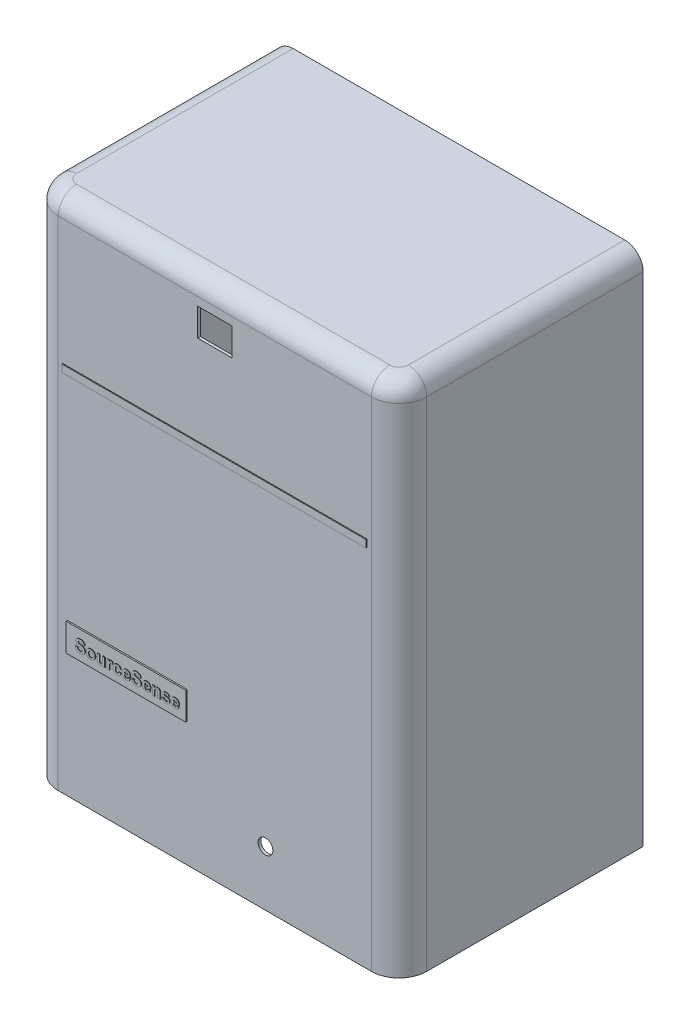
from build123d import *

# Parameters (mm, degrees)
SKETCH1_W                    = 400
SKETCH1_H                    = 265
COVER_BLOCK_DEPTH            = 560
FRONT_CORNER_R30_R           = 30
TOP_FRONT_R20_R              = 20
SHELL_T                      = -3
TFT_WINDOW_START             = 270.5
SKETCH2_W                    = 37
SKETCH2_H                    = 30
TFT_WINDOW_DEPTH             = 4
TAP_HOLE_START               = 270.5
SKETCH3_R                    = 8
TAP_HOLE_DEPTH               = 4
ACCENT_STRIP_START           = 270
SKETCH4_W                    = 330
SKETCH4_H                    = 8
ACCENT_STRIP_DEPTH           = 1
BADGE_PLATE_START            = 270
SKETCH5_W                    = 130
SKETCH5_H                    = 30
BADGE_PLATE_DEPTH            = 1.5
BADGE_TEXT_SOURCESENSE_START = 271.5
BADGE_TEXT_SOURCESENSE_DEPTH = 0.6


with BuildPart() as part:
    # Sketch1 → Cover_Block (new body)
    with BuildSketch(Plane(origin=(0, 0, 0), x_dir=(1, 0, 0), z_dir=(0, 1, 0))):
        with Locations((0, -137.5)):
            Rectangle(SKETCH1_W, SKETCH1_H)
    extrude(amount=COVER_BLOCK_DEPTH)

    # Front_Corner_R30
    front_corner_r30_edges = [part.edges().sort_by_distance(p)[0] for p in [
        (200, 280, 270),
        (-200, 280, 270),
    ]]
    fillet(front_corner_r30_edges, radius=FRONT_CORNER_R30_R)

    # Top_Front_R20
    top_front_r20_edges = [part.edges().sort_by_distance(p)[0] for p in [
        (200, 560, 122.5),
        (0, 560, 270),
        (-191.213203436, 560, 261.213203436),
        (191.213203436, 560, 261.213203436),
        (-200, 560, 122.5),
    ]]
    fillet(top_front_r20_edges, radius=TOP_FRONT_R20_R)

    # Shell
    shell_openings = [part.faces().sort_by_distance(p)[0] for p in [
        (0, 0, 137.039888943),
        (0, 279.788660126, 5),
    ]]
    offset(amount=SHELL_T, openings=shell_openings, kind=Kind.INTERSECTION)

    # Sketch2 → TFT_Window (cut)
    with BuildSketch(Plane.XY.offset(TFT_WINDOW_START)):
        with Locations((0, 516)):
            Rectangle(SKETCH2_W, SKETCH2_H)
    extrude(amount=-TFT_WINDOW_DEPTH, mode=Mode.SUBTRACT)

    # Sketch3 → Tap_Hole (cut)
    with BuildSketch(Plane.XY.offset(TAP_HOLE_START)):
        with Locations(Location((55, 60, 0), (0, 0, 180))):
            Circle(SKETCH3_R)
    extrude(amount=-TAP_HOLE_DEPTH, mode=Mode.SUBTRACT)

    # Sketch4 → Accent_Strip (add)
    with BuildSketch(Plane.XY.offset(ACCENT_STRIP_START)):
        with Locations((0, 400)):
            Rectangle(SKETCH4_W, SKETCH4_H)
    extrude(amount=ACCENT_STRIP_DEPTH)

    # Sketch5 → Badge_Plate (add)
    with BuildSketch(Plane.XY.offset(BADGE_PLATE_START)):
        with Locations((-95, 150)):
            Rectangle(SKETCH5_W, SKETCH5_H)
    extrude(amount=BADGE_PLATE_DEPTH)

    # Sketch6 → Badge_Text_SourceSense (add)
    # profile 1 of 11: a face of its own
    with BuildSketch(Plane.XY.offset(BADGE_TEXT_SOURCESENSE_START)):
        with BuildLine():
            Line((-149.333333333, 147.333333333), (-146.833333333, 147.5))
            add(Edge.make_bspline(
                [(-146.833333333, 147.5), (-146.813416541, 147.395408804), (-146.774729439, 147.192247058), (-146.688773962, 146.902713833), (-146.594160772, 146.632786751), (-146.481092823, 146.38536033), (-146.357312302, 146.15586103), (-146.212650589, 145.950826733), (-146.057199652, 145.763711215), (-145.883264373, 145.601234869), (-145.693764144, 145.45893584), (-145.487753377, 145.337578487), (-145.267464376, 145.232541506), (-145.03235851, 145.146046883), (-144.780012652, 145.081478224), (-144.512625104, 145.035541451), (-144.229812384, 145.006124812), (-144.036532411, 145.002075023), (-143.9375, 145)],
                knots=[0, 0, 0, 0, 1.204560339, 2.339781841, 3.415289417, 4.440034832, 5.416475564, 6.362424008, 7.275913008, 8.16578645, 9.05021719, 9.95355393, 10.867835453, 11.809845306, 12.784702352, 13.812224031, 14.87903166, 16, 16, 16, 16], degree=3))
            add(Edge.make_bspline(
                [(-143.9375, 145), (-143.833262123, 145.001137229), (-143.630514082, 145.003349197), (-143.336709754, 145.030790608), (-143.061989362, 145.070103383), (-142.808778783, 145.132334582), (-142.572349552, 145.201930333), (-142.358573588, 145.297144733), (-142.163991486, 145.406960779), (-141.989104536, 145.531573539), (-141.83648053, 145.66977803), (-141.702957433, 145.814059035), (-141.586667636, 145.961299424), (-141.495139336, 146.118033081), (-141.42106671, 146.277921047), (-141.372109891, 146.445733056), (-141.339036661, 146.617615783), (-141.335244125, 146.735085912), (-141.333333333, 146.794270833)],
                knots=[0, 0, 0, 0, 1.417779877, 2.757654889, 4.012140507, 5.189587551, 6.302846416, 7.360586765, 8.365575446, 9.33904572, 10.275781718, 11.161696098, 12.012180333, 12.822428111, 13.625933072, 14.403138519, 15.195454004, 16, 16, 16, 16], degree=3))
            add(Edge.make_bspline(
                [(-141.333333333, 146.794270833), (-141.335676757, 146.868424739), (-141.340261322, 147.013496004), (-141.395454892, 147.220891269), (-141.478226538, 147.413036989), (-141.602852035, 147.587095171), (-141.770379378, 147.746158981), (-141.984077198, 147.894959283), (-142.249910537, 148.028821358), (-142.447124296, 148.103489873), (-142.552083333, 148.143229167)],
                knots=[0, 0, 0, 0, 0.90494901, 1.770400303, 2.607161909, 3.452839393, 4.36912122, 5.420987164, 6.627424851, 8, 8, 8, 8], degree=3))
            add(Edge.make_bspline(
                [(-142.552083333, 148.143229167), (-142.597118477, 148.158320651), (-142.697899815, 148.192092942), (-142.869822076, 148.240384134), (-143.076907008, 148.300687002), (-143.322147117, 148.369230838), (-143.605459943, 148.439333139), (-143.923681252, 148.525691219), (-144.280690515, 148.611624567), (-144.530454625, 148.675060545), (-144.661458333, 148.708333333)],
                knots=[0, 0, 0, 0, 0.521821638, 1.167752076, 1.961721917, 2.891982557, 3.96540661, 5.168436773, 6.514817513, 8, 8, 8, 8], degree=3))
            add(Edge.make_bspline(
                [(-144.661458333, 148.708333333), (-144.832064042, 148.750929597), (-145.161219858, 148.833112123), (-145.630671426, 148.979309013), (-146.063044905, 149.124563717), (-146.45417724, 149.282172866), (-146.808382782, 149.441454863), (-147.11993215, 149.613592361), (-147.395326696, 149.789645645), (-147.55580549, 149.921232172), (-147.6328125, 149.984375)],
                knots=[0, 0, 0, 0, 1.293880989, 2.496331788, 3.617634808, 4.64976062, 5.598842568, 6.473791081, 7.267636666, 8, 8, 8, 8], degree=3))
            add(Edge.make_bspline(
                [(-147.6328125, 149.984375), (-147.728311202, 150.073790024), (-147.915545238, 150.249096446), (-148.162009786, 150.537158543), (-148.369107118, 150.84145006), (-148.539570895, 151.159724918), (-148.670824779, 151.493815413), (-148.763855844, 151.841485282), (-148.82406893, 152.203641906), (-148.83021326, 152.450279146), (-148.833333333, 152.575520833)],
                knots=[0, 0, 0, 0, 1.064429417, 2.086912298, 3.078678339, 4.055528992, 5.020032834, 5.993708893, 6.981211098, 8, 8, 8, 8], degree=3))
            add(Edge.make_bspline(
                [(-148.833333333, 152.575520833), (-148.827256965, 152.737582083), (-148.815203265, 153.059063226), (-148.704662977, 153.531596622), (-148.532471412, 153.987554955), (-148.332770028, 154.349602756), (-148.140900085, 154.623493288), (-147.981566064, 154.820034626), (-147.806522249, 155.003978425), (-147.61337091, 155.170837712), (-147.409284236, 155.330386392), (-147.186355122, 155.47206753), (-146.950904285, 155.605523325), (-146.610180098, 155.76372896), (-146.147570146, 155.928594771), (-145.545689745, 156.067566187), (-144.890361172, 156.151105958), (-144.436019855, 156.161354522), (-144.200520833, 156.166666667)],
                knots=[0, 0, 0, 0, 1.180131776, 2.341029169, 3.518901375, 4.725685298, 5.343762192, 5.955650671, 6.568945152, 7.192346361, 7.815201106, 8.455999361, 9.116257477, 9.787318263, 11.192748436, 12.688084276, 14.283332633, 16, 16, 16, 16], degree=3))
            add(Edge.make_bspline(
                [(-144.200520833, 156.166666667), (-144.007694035, 156.164088089), (-143.632650035, 156.15907281), (-143.088980192, 156.108357514), (-142.581163061, 156.029425153), (-142.110980631, 155.916118118), (-141.678213831, 155.766409783), (-141.28118513, 155.588078851), (-140.920231907, 155.376355286), (-140.599748409, 155.130024082), (-140.314228331, 154.858459728), (-140.065157725, 154.561832638), (-139.851584345, 154.243889029), (-139.672129816, 153.904861253), (-139.531204646, 153.543006212), (-139.427700672, 153.158775428), (-139.359242247, 152.753073287), (-139.342082935, 152.475082127), (-139.333333333, 152.333333333)],
                knots=[0, 0, 0, 0, 1.325124071, 2.577337985, 3.749592149, 4.855247722, 5.896868755, 6.892903601, 7.842551483, 8.766257401, 9.665194363, 10.546067736, 11.423174165, 12.293291263, 13.177512979, 14.086532529, 15.024315359, 16, 16, 16, 16], degree=3))
            Line((-139.333333333, 152.333333333), (-141.833333333, 152.166666667))
            add(Edge.make_bspline(
                [(-141.833333333, 152.166666667), (-141.847755202, 152.245059962), (-141.875861924, 152.397840341), (-141.936973635, 152.616652884), (-142.00590468, 152.819029529), (-142.086584896, 153.004968976), (-142.184036849, 153.171140876), (-142.290092581, 153.322773082), (-142.407677682, 153.457845182), (-142.540685444, 153.572658465), (-142.68454515, 153.677133848), (-142.848494513, 153.760873285), (-143.025663877, 153.838565051), (-143.222793459, 153.896970207), (-143.436097657, 153.943299275), (-143.665700718, 153.977644635), (-143.912078577, 153.994413973), (-144.081577464, 153.998095364), (-144.169270833, 154)],
                knots=[0, 0, 0, 0, 1.151066407, 2.24330871, 3.278475654, 4.238599069, 5.165719782, 6.056502506, 6.909492653, 7.744782051, 8.590364415, 9.471203867, 10.39832458, 11.382154319, 12.435022857, 13.550631277, 14.73277401, 16, 16, 16, 16], degree=3))
            add(Edge.make_bspline(
                [(-144.169270833, 154), (-144.260447989, 153.99831852), (-144.437837218, 153.995047126), (-144.696340604, 153.974971059), (-144.938836176, 153.937912573), (-145.166514897, 153.889671618), (-145.379072643, 153.824043134), (-145.576060851, 153.744019948), (-145.758380758, 153.649808024), (-145.869551487, 153.575685336), (-145.924479167, 153.5390625)],
                knots=[0, 0, 0, 0, 1.186678824, 2.308736671, 3.37120409, 4.377216403, 5.334874112, 6.262130804, 7.141346615, 8, 8, 8, 8], degree=3))
            add(Edge.make_bspline(
                [(-145.924479167, 153.5390625), (-145.987339284, 153.489034666), (-146.109079821, 153.39214628), (-146.2400984, 153.199758888), (-146.318971887, 152.982463097), (-146.328465205, 152.828798478), (-146.333333333, 152.75)],
                knots=[0, 0, 0, 0, 1.037857257, 2.010007357, 2.979541333, 4, 4, 4, 4], degree=3))
            add(Edge.make_bspline(
                [(-146.333333333, 152.75), (-146.329352092, 152.67635759), (-146.32150968, 152.531293763), (-146.242408855, 152.325227457), (-146.120762561, 152.134292202), (-146.007104053, 152.030573669), (-145.947916667, 151.9765625)],
                knots=[0, 0, 0, 0, 0.98538058, 1.941042925, 2.927803204, 4, 4, 4, 4], degree=3))
            add(Edge.make_bspline(
                [(-145.947916667, 151.9765625), (-145.900943849, 151.941506542), (-145.795979153, 151.863171066), (-145.603704637, 151.763599266), (-145.371624249, 151.655756991), (-145.094447119, 151.55032926), (-144.774015359, 151.445097232), (-144.410309482, 151.335222828), (-144.003105794, 151.223873258), (-143.562783716, 151.116036653), (-143.115732793, 151.010039465), (-142.689124414, 150.894154621), (-142.292439971, 150.781175861), (-141.927518775, 150.662755787), (-141.592479726, 150.547474212), (-141.288950324, 150.429071731), (-141.014846419, 150.313760964), (-140.695210879, 150.155200491), (-140.332936142, 149.940423922), (-139.95323135, 149.62821036), (-139.617430914, 149.277261925), (-139.383454095, 148.94634176), (-139.222724263, 148.661741611), (-139.119231211, 148.434882154), (-139.029701602, 148.195829489), (-138.956824745, 147.944319446), (-138.904006559, 147.679998118), (-138.860296436, 147.404884924), (-138.837964124, 147.116694988), (-138.834893543, 146.920169959), (-138.833333333, 146.8203125)],
                knots=[0, 0, 0, 0, 0.511875881, 1.143829537, 1.88775736, 2.750598373, 3.734912702, 4.837306479, 6.073130119, 7.42648979, 8.801963576, 10.091065733, 11.292408984, 12.408830014, 13.446061236, 14.39066453, 15.257936293, 16.045629259, 17.510392066, 18.929669597, 20.331293837, 21.746891395, 22.460690638, 23.187651344, 23.925159671, 24.69163991, 25.474819891, 26.281170188, 27.126635539, 28, 28, 28, 28], degree=3))
            add(Edge.make_bspline(
                [(-138.833333333, 146.8203125), (-138.835478672, 146.728221598), (-138.839739108, 146.545337987), (-138.869512184, 146.27389254), (-138.915555502, 146.007267463), (-138.98371543, 145.745128507), (-139.074136529, 145.487991356), (-139.175943503, 145.232144811), (-139.303247391, 144.983168345), (-139.448136579, 144.740855746), (-139.607955936, 144.505388853), (-139.789060953, 144.288176007), (-139.980814229, 144.081970466), (-140.195468286, 143.898318587), (-140.419767757, 143.722349978), (-140.663971865, 143.56650922), (-140.922359267, 143.42548713), (-141.196563699, 143.300336584), (-141.487557369, 143.191279195), (-141.794962334, 143.094210536), (-142.12154813, 143.014767295), (-142.464591497, 142.946674429), (-142.82534782, 142.894891565), (-143.203366074, 142.858735084), (-143.598732197, 142.838345009), (-143.868032835, 142.835024648), (-144.005208333, 142.833333333)],
                knots=[0, 0, 0, 0, 0.900570041, 1.788444861, 2.667795364, 3.545012114, 4.433698372, 5.332345486, 6.235991676, 7.164928091, 8.092777575, 9.015680987, 9.928493428, 10.842962589, 11.775229507, 12.714851019, 13.672254427, 14.652424454, 15.660007982, 16.709910502, 17.803296389, 18.945495772, 20.129342395, 21.366102753, 22.658353839, 24, 24, 24, 24], degree=3))
            add(Edge.make_bspline(
                [(-144.005208333, 142.833333333), (-144.203268587, 142.836567004), (-144.588896599, 142.842863037), (-145.149144842, 142.899217486), (-145.674620605, 142.985472035), (-146.164468453, 143.110656483), (-146.619287101, 143.271365056), (-147.038869108, 143.469322532), (-147.421185008, 143.705711603), (-147.770969984, 143.974799435), (-148.083563702, 144.281489488), (-148.364648604, 144.619427259), (-148.610432773, 144.991655818), (-148.820754659, 145.397592955), (-149.000931561, 145.835044176), (-149.149525187, 146.304210352), (-149.261408377, 146.807329155), (-149.308943701, 147.154966195), (-149.333333333, 147.333333333)],
                knots=[0, 0, 0, 0, 1.217954099, 2.371385517, 3.459848295, 4.490682126, 5.476952527, 6.422732854, 7.338496285, 8.236688651, 9.131557988, 10.026443255, 10.935708282, 11.869506048, 12.834296687, 13.842423496, 14.892981177, 16, 16, 16, 16], degree=3))
        make_face()
    # profile 2 of 11: a face of its own
    with BuildSketch(Plane.XY.offset(BADGE_TEXT_SOURCESENSE_START)):
        with BuildLine():
            add(Edge.make_bspline(
                [(-137.333333333, 147.8828125), (-137.325312516, 148.088133323), (-137.309255334, 148.499172954), (-137.194560951, 149.109750816), (-137.000422735, 149.708071896), (-136.783114997, 150.193525791), (-136.568544991, 150.564651984), (-136.395266027, 150.832273028), (-136.201818966, 151.079788885), (-135.992163143, 151.3087681), (-135.771014701, 151.524700041), (-135.530586697, 151.719641122), (-135.27398871, 151.896950484), (-135.003726216, 152.058584159), (-134.720185578, 152.200502927), (-134.428630775, 152.326654301), (-134.12788361, 152.430308188), (-133.820039495, 152.516266315), (-133.503763547, 152.585207783), (-133.178968537, 152.630344806), (-132.846047798, 152.660441984), (-132.621595221, 152.664572677), (-132.5078125, 152.666666667)],
                knots=[0, 0, 0, 0, 1.619840069, 3.242819969, 4.882696853, 6.574901176, 7.427927767, 8.263869039, 9.088735507, 9.903385011, 10.712399333, 11.525463381, 12.34252837, 13.171904741, 14.008210778, 14.842888174, 15.67691885, 16.516221154, 17.363978437, 18.229048737, 19.10224397, 20, 20, 20, 20], degree=3))
            add(Edge.make_bspline(
                [(-132.5078125, 152.666666667), (-132.334864438, 152.662967868), (-131.994640221, 152.655691575), (-131.496571159, 152.589413104), (-131.02307138, 152.480220773), (-130.573501891, 152.328180436), (-130.147523838, 152.133276591), (-129.747279937, 151.891014145), (-129.369463421, 151.608500941), (-129.021225193, 151.284013798), (-128.702919387, 150.928719875), (-128.426855467, 150.54461365), (-128.191231303, 150.139125334), (-127.996082434, 149.711610302), (-127.847952384, 149.259812413), (-127.745615878, 148.784837619), (-127.677088206, 148.288447648), (-127.670184811, 147.949021699), (-127.666666667, 147.776041667)],
                knots=[0, 0, 0, 0, 1.076054793, 2.116819909, 3.120736197, 4.09633837, 5.065772102, 6.030360709, 7.002891056, 7.996945094, 8.988102315, 9.967288529, 10.93568283, 11.902870597, 12.887008047, 13.888537105, 14.923945207, 16, 16, 16, 16], degree=3))
            add(Edge.make_bspline(
                [(-127.666666667, 147.776041667), (-127.670198821, 147.601333549), (-127.677113351, 147.259325645), (-127.745232967, 146.75832652), (-127.850566333, 146.279153605), (-128.001720163, 145.822778863), (-128.196450748, 145.38972588), (-128.431050824, 144.97851548), (-128.711735239, 144.591310197), (-129.033122981, 144.23214571), (-129.385859797, 143.905882758), (-129.760963012, 143.615840379), (-130.162958691, 143.376727752), (-130.584795149, 143.175659907), (-131.030812443, 143.023073068), (-131.49846946, 142.914235062), (-131.987409591, 142.843251998), (-132.321795916, 142.836681453), (-132.4921875, 142.833333333)],
                knots=[0, 0, 0, 0, 1.084306555, 2.122634113, 3.133511532, 4.127271514, 5.10202058, 6.077484774, 7.061903265, 8.065960046, 9.065303363, 10.042062392, 11.004391854, 11.964060687, 12.939122686, 13.924942149, 14.942623041, 16, 16, 16, 16], degree=3))
            add(Edge.make_bspline(
                [(-132.4921875, 142.833333333), (-132.704459734, 142.840286987), (-133.127493818, 142.854144818), (-133.753495326, 142.967813132), (-134.364034286, 143.151211612), (-134.855914553, 143.362309889), (-135.231657088, 143.568158576), (-135.498124001, 143.741435262), (-135.749426164, 143.927393225), (-135.979683549, 144.135596211), (-136.192870116, 144.360065747), (-136.391810005, 144.598628461), (-136.569419641, 144.856790893), (-136.730659917, 145.129862702), (-136.875342754, 145.419795664), (-136.995956707, 145.727386287), (-137.10074821, 146.0490217), (-137.187176782, 146.385432263), (-137.251262832, 146.738060495), (-137.297859659, 147.105776504), (-137.32705962, 147.489115727), (-137.331216083, 147.749947842), (-137.333333333, 147.8828125)],
                knots=[0, 0, 0, 0, 1.610846835, 3.210231987, 4.81374032, 6.443368681, 7.263437361, 8.06418174, 8.855100662, 9.634539345, 10.417731031, 11.204243685, 11.990424874, 12.794120493, 13.610605693, 14.447765341, 15.300248309, 16.177865431, 17.082777535, 18.019649293, 18.991233806, 20, 20, 20, 20], degree=3))
        make_face()
        with BuildLine():
            add(Edge.make_bspline(
                [(-134.833333333, 147.75), (-134.831480504, 147.629261432), (-134.827874897, 147.394304149), (-134.795739227, 147.052456112), (-134.74593059, 146.73144118), (-134.669012196, 146.434243506), (-134.57625616, 146.156847001), (-134.458512481, 145.90294107), (-134.323969341, 145.667717011), (-134.163847965, 145.459973842), (-133.9893312, 145.276079568), (-133.806420685, 145.112679139), (-133.613322396, 144.973544791), (-133.408850322, 144.860425022), (-133.193257201, 144.774549312), (-132.969087347, 144.711534198), (-132.734728529, 144.674514679), (-132.575650367, 144.669311446), (-132.494791667, 144.666666667)],
                knots=[0, 0, 0, 0, 1.334287467, 2.596523749, 3.792235791, 4.920928783, 5.98599801, 7.020725633, 8.009778093, 8.975087571, 9.91178927, 10.809031968, 11.682407688, 12.537028737, 13.385161363, 14.241880569, 15.106355953, 16, 16, 16, 16], degree=3))
            add(Edge.make_bspline(
                [(-132.494791667, 144.666666667), (-132.413929462, 144.669302766), (-132.254844405, 144.674488921), (-132.020535857, 144.71163295), (-131.796955196, 144.773967329), (-131.582758362, 144.861126715), (-131.378815332, 144.973442106), (-131.185837284, 145.112772263), (-131.003058691, 145.275405604), (-130.829961072, 145.460292023), (-130.67447232, 145.670863912), (-130.538610744, 145.905353648), (-130.420870699, 146.160231508), (-130.327686088, 146.439099375), (-130.254983245, 146.739717358), (-130.203997345, 147.062817296), (-130.172121075, 147.40821335), (-130.168522127, 147.64576034), (-130.166666667, 147.768229167)],
                knots=[0, 0, 0, 0, 0.891374549, 1.753654511, 2.608197993, 3.445305504, 4.297756158, 5.168913853, 6.063877914, 6.991658187, 7.956416983, 8.942957645, 9.975057474, 11.046479855, 12.179282068, 13.381405243, 14.649967197, 16, 16, 16, 16], degree=3))
            add(Edge.make_bspline(
                [(-130.166666667, 147.768229167), (-130.168531335, 147.888092626), (-130.172145852, 148.120438863), (-130.203842403, 148.458083883), (-130.255679983, 148.774929545), (-130.327128403, 149.07065611), (-130.421354355, 149.345768717), (-130.539347939, 149.597722809), (-130.673579, 149.831530153), (-130.830869963, 150.039898568), (-131.002948756, 150.22467535), (-131.185865455, 150.387206993), (-131.378808044, 150.526563261), (-131.582760257, 150.63887189), (-131.796954681, 150.72603305), (-132.020535997, 150.788366947), (-132.254844369, 150.825511106), (-132.413929449, 150.830697243), (-132.494791667, 150.833333333)],
                knots=[0, 0, 0, 0, 1.332105243, 2.582185114, 3.76554119, 4.898206757, 5.96011018, 6.991864232, 7.986448439, 8.951336849, 9.886681577, 10.788942532, 11.667203022, 12.526603947, 13.370536632, 14.232047448, 15.101357822, 16, 16, 16, 16], degree=3))
            add(Edge.make_bspline(
                [(-132.494791667, 150.833333333), (-132.575650367, 150.830688554), (-132.734728529, 150.825485321), (-132.969087347, 150.788465802), (-133.193257201, 150.725450688), (-133.408850322, 150.639574978), (-133.613322396, 150.526455209), (-133.806420685, 150.387320861), (-133.9893312, 150.223920432), (-134.163847965, 150.040026158), (-134.323969341, 149.832282989), (-134.458512481, 149.59705893), (-134.57625616, 149.343152999), (-134.669012196, 149.065756494), (-134.74593059, 148.76855882), (-134.795739227, 148.447543888), (-134.827874897, 148.105695851), (-134.831480504, 147.870738568), (-134.833333333, 147.75)],
                knots=[0, 0, 0, 0, 0.893644047, 1.758119431, 2.614838637, 3.462971263, 4.317592312, 5.190968032, 6.08821073, 7.024912429, 7.990221907, 8.979274367, 10.01400199, 11.079071217, 12.207764209, 13.403476251, 14.665712533, 16, 16, 16, 16], degree=3))
        make_face(mode=Mode.SUBTRACT)
    # profile 3 of 11: a face of its own
    with BuildSketch(Plane.XY.offset(BADGE_TEXT_SOURCESENSE_START)):
        with BuildLine():
            Line((-119.833333333, 143), (-119.833333333, 144.3984375))
            add(Edge.make_bspline(
                [(-119.833333333, 144.3984375), (-119.916105352, 144.278745035), (-120.080356032, 144.041230364), (-120.382201093, 143.729988102), (-120.720216748, 143.459921307), (-121.092047181, 143.234842391), (-121.486275162, 143.055323399), (-121.896298985, 142.926429336), (-122.317383514, 142.849000483), (-122.602115716, 142.838563289), (-122.744791667, 142.833333333)],
                knots=[0, 0, 0, 0, 1.012300957, 2.008784164, 3.006972158, 4.019128624, 5.028517728, 6.017265291, 7.006475003, 8, 8, 8, 8], degree=3))
            add(Edge.make_bspline(
                [(-122.744791667, 142.833333333), (-122.889252987, 142.838115395), (-123.172563656, 142.847493748), (-123.585363325, 142.927892357), (-123.975028319, 143.059299316), (-124.339619982, 143.239992209), (-124.666951482, 143.471266088), (-124.951917415, 143.74509969), (-125.182205439, 144.065751234), (-125.335165131, 144.363899956), (-125.431152036, 144.626031609), (-125.492519252, 144.843180319), (-125.548152423, 145.078369404), (-125.590839302, 145.331614584), (-125.625469742, 145.602631301), (-125.647228308, 145.891232988), (-125.664125278, 146.198588337), (-125.665803745, 146.409696016), (-125.666666667, 146.518229167)],
                knots=[0, 0, 0, 0, 1.289498181, 2.528902495, 3.740215999, 4.953909685, 6.150063847, 7.307074614, 8.467199117, 9.660131987, 10.288158488, 10.958106275, 11.674712228, 12.445953132, 13.25095176, 14.114470792, 15.030625377, 16, 16, 16, 16], degree=3))
            Line((-125.666666667, 146.518229167), (-125.666666667, 152.5))
            Line((-125.666666667, 152.5), (-123.166666667, 152.5))
            Line((-123.166666667, 152.5), (-123.166666667, 148.1171875))
            add(Edge.make_bspline(
                [(-123.166666667, 148.1171875), (-123.165933642, 147.957465758), (-123.164543247, 147.654506874), (-123.160495485, 147.223891494), (-123.149388488, 146.842823792), (-123.137523386, 146.510227091), (-123.119930086, 146.226214979), (-123.097117927, 145.990798532), (-123.071652995, 145.803953594), (-123.0368366, 145.621803183), (-122.965352001, 145.438986766), (-122.866887872, 145.242607831), (-122.732283843, 145.074038163), (-122.576572737, 144.927631285), (-122.395122547, 144.806313242), (-122.185819164, 144.729707804), (-121.957893642, 144.672527329), (-121.797282697, 144.668675154), (-121.713541667, 144.666666667)],
                knots=[0, 0, 0, 0, 1.799930418, 3.414093185, 4.852592097, 6.095879458, 7.164323302, 8.058836106, 8.760219181, 9.289718358, 10.143846288, 10.96209893, 11.756558504, 12.559405005, 13.365225682, 14.195378484, 15.059087384, 16, 16, 16, 16], degree=3))
            add(Edge.make_bspline(
                [(-121.713541667, 144.666666667), (-121.616851068, 144.671485411), (-121.426447145, 144.680974522), (-121.148170033, 144.747102789), (-120.888284112, 144.861946757), (-120.645949727, 145.014712163), (-120.433785861, 145.203851596), (-120.249551475, 145.413930064), (-120.106039359, 145.647385714), (-120.014530088, 145.864966197), (-119.959693067, 146.071040071), (-119.929605368, 146.275573818), (-119.896593549, 146.525312602), (-119.876408034, 146.82367043), (-119.853709485, 147.168993569), (-119.842749824, 147.56244743), (-119.834502193, 148.003433581), (-119.833736518, 148.313361983), (-119.833333333, 148.4765625)],
                knots=[0, 0, 0, 0, 0.960139447, 1.890714513, 2.821289579, 3.770841791, 4.723832156, 5.63466777, 6.536687779, 7.433335375, 7.968708987, 8.650470788, 9.484586637, 10.470508532, 11.619255361, 12.921832212, 14.379114108, 16, 16, 16, 16], degree=3))
            Line((-119.833333333, 148.4765625), (-119.833333333, 152.5))
            Line((-119.833333333, 152.5), (-117.333333333, 152.5))
            Line((-117.333333333, 152.5), (-117.333333333, 143))
            Line((-117.333333333, 143), (-119.833333333, 143))
        make_face()
    # profile 4 of 11: a face of its own
    with BuildSketch(Plane.XY.offset(BADGE_TEXT_SOURCESENSE_START)):
        with BuildLine():
            Line((-112.166666667, 143), (-114.666666667, 143))
            Line((-114.666666667, 143), (-114.666666667, 152.5))
            Line((-114.666666667, 152.5), (-112.166666667, 152.5))
            Line((-112.166666667, 152.5), (-112.166666667, 151.174479167))
            add(Edge.make_bspline(
                [(-112.166666667, 151.174479167), (-112.123470922, 151.249250864), (-112.040136122, 151.39350314), (-111.916862701, 151.599218302), (-111.794186996, 151.782554445), (-111.673244971, 151.943513526), (-111.561107149, 152.088133394), (-111.447022693, 152.208253593), (-111.339840685, 152.311459236), (-111.19643345, 152.414633028), (-111.012383157, 152.515328083), (-110.781056319, 152.605841791), (-110.533312251, 152.655312332), (-110.364786249, 152.662826085), (-110.278645833, 152.666666667)],
                knots=[0, 0, 0, 0, 1.218987753, 2.351715484, 3.384890168, 4.330893419, 5.1939795, 5.965577503, 6.66790098, 7.29043559, 8.453252551, 9.620708942, 10.783848683, 12, 12, 12, 12], degree=3))
            add(Edge.make_bspline(
                [(-110.278645833, 152.666666667), (-110.153931268, 152.659665035), (-109.903445048, 152.645602425), (-109.532371853, 152.545155494), (-109.171571555, 152.375121423), (-108.948445532, 152.22043088), (-108.833333333, 152.140625)],
                knots=[0, 0, 0, 0, 0.956058025, 1.920219652, 2.927027487, 4, 4, 4, 4], degree=3))
            Line((-108.833333333, 152.140625), (-109.416666667, 149.763020833))
            add(Edge.make_bspline(
                [(-109.416666667, 149.763020833), (-109.514991097, 149.824861152), (-109.702318073, 149.942678871), (-109.994712469, 150.067845474), (-110.275945991, 150.149792042), (-110.462173693, 150.16117233), (-110.552083333, 150.166666667)],
                knots=[0, 0, 0, 0, 1.139741959, 2.17142794, 3.117176162, 4, 4, 4, 4], degree=3))
            add(Edge.make_bspline(
                [(-110.552083333, 150.166666667), (-110.633114339, 150.163205173), (-110.790859841, 150.156466579), (-111.017941807, 150.10280166), (-111.227297985, 150.016339506), (-111.419760706, 149.892048343), (-111.591880458, 149.718208465), (-111.740061226, 149.489197121), (-111.864077023, 149.202900765), (-111.958865189, 148.925006593), (-112.017969208, 148.654904099), (-112.059650243, 148.397711909), (-112.091319497, 148.089815253), (-112.120310456, 147.732147269), (-112.139743247, 147.323917455), (-112.155041399, 146.866410895), (-112.166090686, 146.358559031), (-112.16646883, 146.003478517), (-112.166666667, 145.817708333)],
                knots=[0, 0, 0, 0, 0.752818562, 1.4655346, 2.15662141, 2.850671748, 3.581264886, 4.414089304, 5.371394652, 6.476667933, 7.138571115, 7.940099809, 8.898357565, 10.015825393, 11.276710544, 12.698206094, 14.272575274, 16, 16, 16, 16], degree=3))
            Line((-112.166666667, 145.817708333), (-112.166666667, 143))
        make_face()
    # profile 5 of 11: a face of its own
    with BuildSketch(Plane.XY.offset(BADGE_TEXT_SOURCESENSE_START)):
        with BuildLine():
            Line((-99.833333333, 149.666666667), (-102.333333333, 149.333333333))
            add(Edge.make_bspline(
                [(-102.333333333, 149.333333333), (-102.356310801, 149.450408936), (-102.400146379, 149.673761511), (-102.511292123, 149.983067198), (-102.663302231, 150.245960123), (-102.853404358, 150.460746317), (-103.077168498, 150.628121895), (-103.331327321, 150.750175499), (-103.618603367, 150.821173853), (-103.819909839, 150.829176389), (-103.924479167, 150.833333333)],
                knots=[0, 0, 0, 0, 1.183520367, 2.2578771, 3.246797608, 4.180863388, 5.085846032, 6.003342148, 6.962829327, 8, 8, 8, 8], degree=3))
            add(Edge.make_bspline(
                [(-103.924479167, 150.833333333), (-103.995758321, 150.831376237), (-104.134697823, 150.827561405), (-104.337930841, 150.796467932), (-104.528313133, 150.740098718), (-104.710712056, 150.668355208), (-104.879130376, 150.570633859), (-105.038557422, 150.455127109), (-105.184001007, 150.315453462), (-105.320347777, 150.15581279), (-105.445712043, 149.971705567), (-105.547302779, 149.756242738), (-105.636381745, 149.514932803), (-105.708778865, 149.244636315), (-105.764595203, 148.94592764), (-105.806604786, 148.619079234), (-105.829052895, 148.264208734), (-105.831870936, 148.018258636), (-105.833333333, 147.890625)],
                knots=[0, 0, 0, 0, 0.862078219, 1.680389174, 2.478024961, 3.259954283, 4.04533088, 4.826625376, 5.636266677, 6.477958853, 7.363321064, 8.321359119, 9.351280941, 10.472100686, 11.701575432, 13.024867311, 14.456081111, 16, 16, 16, 16], degree=3))
            add(Edge.make_bspline(
                [(-105.833333333, 147.890625), (-105.83220949, 147.749083333), (-105.830042435, 147.476155276), (-105.803049197, 147.082533188), (-105.762821956, 146.721646219), (-105.706136808, 146.392502592), (-105.631665962, 146.096260861), (-105.540349227, 145.831378937), (-105.435880542, 145.596965431), (-105.30769536, 145.397449389), (-105.170338573, 145.222894696), (-105.015670266, 145.077276361), (-104.855968437, 144.946393064), (-104.678470217, 144.846323224), (-104.49374279, 144.762700121), (-104.294562295, 144.710702767), (-104.086667709, 144.670687646), (-103.9429183, 144.668022467), (-103.869791667, 144.666666667)],
                knots=[0, 0, 0, 0, 1.594318435, 3.074248329, 4.44256617, 5.683784585, 6.834147545, 7.879495874, 8.83778105, 9.716843238, 10.544636748, 11.333080285, 12.105903466, 12.864046512, 13.621684801, 14.38335177, 15.177596319, 16, 16, 16, 16], degree=3))
            add(Edge.make_bspline(
                [(-103.869791667, 144.666666667), (-103.762497106, 144.671279785), (-103.554391931, 144.680227246), (-103.258884031, 144.76039312), (-102.993450946, 144.890214562), (-102.800972575, 145.042848639), (-102.661190027, 145.189843879), (-102.570141386, 145.325242512), (-102.478545572, 145.473384268), (-102.403384673, 145.644809542), (-102.328531166, 145.831331375), (-102.268649022, 146.038860705), (-102.209170312, 146.262133864), (-102.181137875, 146.419013762), (-102.166666667, 146.5)],
                knots=[0, 0, 0, 0, 1.391704634, 2.699306801, 3.945045311, 5.206156062, 5.868460975, 6.572467336, 7.320954464, 8.128297893, 8.999513781, 9.930638866, 10.931732014, 12, 12, 12, 12], degree=3))
            Line((-102.166666667, 146.5), (-99.666666667, 146.166666667))
            add(Edge.make_bspline(
                [(-99.666666667, 146.166666667), (-99.699578353, 146.033351426), (-99.764079572, 145.772076586), (-99.889443704, 145.396878475), (-100.035776582, 145.046187909), (-100.201380251, 144.719014225), (-100.392441802, 144.418891221), (-100.603659164, 144.143748598), (-100.837351576, 143.895215637), (-101.090512104, 143.669397717), (-101.367088683, 143.470952265), (-101.667505347, 143.301478563), (-101.987372687, 143.154475948), (-102.331961546, 143.038730828), (-102.696987661, 142.943352512), (-103.085915899, 142.88053479), (-103.496537916, 142.84019373), (-103.777676282, 142.83565916), (-103.921875, 142.833333333)],
                knots=[0, 0, 0, 0, 1.110268429, 2.175934317, 3.195555169, 4.181481111, 5.137790904, 6.068820232, 6.982751273, 7.892872169, 8.808581235, 9.729898078, 10.678730826, 11.651191499, 12.666063818, 13.726769105, 14.834036833, 16, 16, 16, 16], degree=3))
            add(Edge.make_bspline(
                [(-103.921875, 142.833333333), (-104.086129033, 142.837317791), (-104.406223846, 142.845082619), (-104.873707709, 142.906090741), (-105.315662304, 143.006381074), (-105.732180425, 143.151480339), (-106.125025722, 143.332402979), (-106.490158183, 143.559629492), (-106.829564016, 143.826247141), (-107.142450735, 144.131487248), (-107.424033079, 144.47202842), (-107.667111577, 144.847644306), (-107.873368934, 145.253645895), (-108.043340151, 145.690445213), (-108.172977078, 146.160123199), (-108.264990256, 146.660298972), (-108.324356263, 147.191284822), (-108.330289445, 147.555390909), (-108.333333333, 147.7421875)],
                knots=[0, 0, 0, 0, 1.056003706, 2.057917874, 3.026125023, 3.965316587, 4.889355399, 5.801804771, 6.724223409, 7.659808022, 8.607570672, 9.559810849, 10.530974559, 11.531347954, 12.568834288, 13.659317828, 14.799164681, 16, 16, 16, 16], degree=3))
            add(Edge.make_bspline(
                [(-108.333333333, 147.7421875), (-108.33028153, 147.93071931), (-108.324331639, 148.298286765), (-108.265135215, 148.83360459), (-108.173221885, 149.337350099), (-108.042476601, 149.808837914), (-107.877246254, 150.248922869), (-107.66943723, 150.654844543), (-107.426739274, 151.030640763), (-107.144923018, 151.370972059), (-106.832969027, 151.676487445), (-106.491529507, 151.94095475), (-106.125521655, 152.166938657), (-105.731548267, 152.349131021), (-105.31220413, 152.493937688), (-104.865841233, 152.593861299), (-104.393186063, 152.654918675), (-104.069634529, 152.662683268), (-103.903645833, 152.666666667)],
                knots=[0, 0, 0, 0, 1.206261992, 2.351765734, 3.442553085, 4.480484798, 5.479315179, 6.445885781, 7.393622348, 8.336902565, 9.26806234, 10.182699256, 11.09556262, 12.0152312, 12.955233282, 13.92969179, 14.937888647, 16, 16, 16, 16], degree=3))
            add(Edge.make_bspline(
                [(-103.903645833, 152.666666667), (-103.768124752, 152.665285001), (-103.503500865, 152.662587105), (-103.117553267, 152.623600316), (-102.752525006, 152.568602878), (-102.408695145, 152.486978566), (-102.085910583, 152.383975807), (-101.784723243, 152.256476078), (-101.506360013, 152.103527133), (-101.247294067, 151.929466178), (-101.00904917, 151.728766428), (-100.786710159, 151.507443522), (-100.582758448, 151.260074006), (-100.394795792, 150.99001432), (-100.229072064, 150.692921469), (-100.076740506, 150.374400318), (-99.944544651, 150.029880226), (-99.870954253, 149.78953571), (-99.833333333, 149.666666667)],
                knots=[0, 0, 0, 0, 1.178528697, 2.301242291, 3.371523624, 4.388184023, 5.372173667, 6.316227488, 7.228761945, 8.131556558, 9.02696084, 9.934795517, 10.857276148, 11.812560878, 12.793328268, 13.813516901, 14.882225015, 16, 16, 16, 16], degree=3))
        make_face()
    # profile 6 of 11: a face of its own
    with BuildSketch(Plane.XY.offset(BADGE_TEXT_SOURCESENSE_START)):
        with BuildLine():
            Line((-92.333333333, 146), (-89.833333333, 145.666666667))
            add(Edge.make_bspline(
                [(-89.833333333, 145.666666667), (-89.874224327, 145.554028686), (-89.954624737, 145.332558406), (-90.101516813, 145.016768461), (-90.265713239, 144.722037462), (-90.446424638, 144.446790667), (-90.642978476, 144.190668961), (-90.861874034, 143.959060058), (-91.092447741, 143.743341931), (-91.344344398, 143.553786378), (-91.611252384, 143.383313092), (-91.894513033, 143.23415077), (-92.196391643, 143.112671355), (-92.512316796, 143.010940563), (-92.843722512, 142.929738916), (-93.191960859, 142.872970984), (-93.556585057, 142.838480461), (-93.805478064, 142.835070662), (-93.932291667, 142.833333333)],
                knots=[0, 0, 0, 0, 1.071172907, 2.106154283, 3.1104349, 4.085737425, 5.048416355, 5.993087888, 6.932482331, 7.868664062, 8.80754521, 9.762367971, 10.726735429, 11.713584758, 12.728370439, 13.774815933, 14.866245336, 16, 16, 16, 16], degree=3))
            add(Edge.make_bspline(
                [(-93.932291667, 142.833333333), (-94.130459154, 142.838224476), (-94.515285335, 142.847722703), (-95.072039391, 142.924050765), (-95.589145539, 143.048322334), (-96.067599714, 143.222388866), (-96.505811631, 143.450720467), (-96.904441149, 143.728366707), (-97.264270036, 144.055931), (-97.465954695, 144.309546362), (-97.567708333, 144.4375)],
                knots=[0, 0, 0, 0, 1.150944905, 2.235047425, 3.25761485, 4.235688044, 5.185329112, 6.119879054, 7.051444229, 8, 8, 8, 8], degree=3))
            add(Edge.make_bspline(
                [(-97.567708333, 144.4375), (-97.642802544, 144.546387771), (-97.794020362, 144.765655956), (-97.981989666, 145.12094753), (-98.14271914, 145.496274902), (-98.270766357, 145.892713166), (-98.377209077, 146.308756055), (-98.448825188, 146.747046676), (-98.490102534, 147.206665243), (-98.496656212, 147.519880304), (-98.5, 147.6796875)],
                knots=[0, 0, 0, 0, 0.92479112, 1.862259343, 2.806490716, 3.778329015, 4.774107667, 5.808532634, 6.881879269, 8, 8, 8, 8], degree=3))
            add(Edge.make_bspline(
                [(-98.5, 147.6796875), (-98.497249975, 147.869124487), (-98.491873971, 148.239453436), (-98.428226405, 148.777784867), (-98.338416043, 149.286849425), (-98.201449188, 149.761358474), (-98.030258941, 150.206724754), (-97.81540853, 150.617221072), (-97.567584535, 151.000314283), (-97.277821651, 151.344434536), (-96.960276935, 151.653852631), (-96.622349792, 151.926501887), (-96.261510469, 152.154236155), (-95.883133574, 152.344313688), (-95.480923204, 152.486590939), (-95.059913383, 152.591325676), (-94.618263309, 152.655107719), (-94.317050727, 152.662773272), (-94.1640625, 152.666666667)],
                knots=[0, 0, 0, 0, 1.222152375, 2.389176539, 3.494777592, 4.555389183, 5.572001132, 6.56945427, 7.540785438, 8.511469914, 9.46642023, 10.399267108, 11.30862844, 12.215760073, 13.126777173, 14.056336669, 15.012798191, 16, 16, 16, 16], degree=3))
            add(Edge.make_bspline(
                [(-94.1640625, 152.666666667), (-93.992837619, 152.663046481), (-93.657768475, 152.655962157), (-93.16923888, 152.589455202), (-92.707982882, 152.481280066), (-92.275507175, 152.325838603), (-91.868991642, 152.13092255), (-91.491459682, 151.889363458), (-91.142891913, 151.603367312), (-90.82414913, 151.273056057), (-90.535681478, 150.900601638), (-90.290150535, 150.478819701), (-90.084607206, 150.012069719), (-89.917970452, 149.499148342), (-89.794777847, 148.938981759), (-89.710484323, 148.333027754), (-89.662413112, 147.681341932), (-89.665219253, 147.231849339), (-89.666666667, 147)],
                knots=[0, 0, 0, 0, 0.994942504, 1.946998194, 2.860087576, 3.744358974, 4.613292, 5.475605888, 6.343365869, 7.228414471, 8.138836547, 9.075277299, 10.058013037, 11.098483422, 12.205225682, 13.387753975, 14.652597341, 16, 16, 16, 16], degree=3))
            Line((-89.666666667, 147), (-96, 147))
            add(Edge.make_bspline(
                [(-96, 147), (-95.995900019, 146.910518599), (-95.987916041, 146.736269608), (-95.957673424, 146.481564664), (-95.905318289, 146.24314907), (-95.83680237, 146.019576389), (-95.755330271, 145.810689736), (-95.651691314, 145.618494948), (-95.532285911, 145.440540127), (-95.394245739, 145.279727195), (-95.243103011, 145.136972599), (-95.0836134, 145.011518355), (-94.916021713, 144.901818579), (-94.735998102, 144.818384899), (-94.549527813, 144.747934566), (-94.353254011, 144.702776919), (-94.148490415, 144.672769755), (-94.008792803, 144.668728875), (-93.9375, 144.666666667)],
                knots=[0, 0, 0, 0, 1.231756261, 2.398624542, 3.522625857, 4.583815436, 5.612473245, 6.600564899, 7.580690863, 8.554470542, 9.508734211, 10.435415665, 11.342824763, 12.255949018, 13.158633635, 14.07945191, 15.019874036, 16, 16, 16, 16], degree=3))
            add(Edge.make_bspline(
                [(-93.9375, 144.666666667), (-93.842609807, 144.670874139), (-93.65882166, 144.679023386), (-93.39390341, 144.736120984), (-93.153534537, 144.836742144), (-92.935196361, 144.977019981), (-92.740918869, 145.163309126), (-92.57803732, 145.400585996), (-92.435625314, 145.681443067), (-92.368552548, 145.890320581), (-92.333333333, 146)],
                knots=[0, 0, 0, 0, 1.004430367, 1.945431754, 2.851730883, 3.749038912, 4.678525969, 5.68064125, 6.782128749, 8, 8, 8, 8], degree=3))
        make_face()
        with BuildLine():
            add(Edge.make_bspline(
                [(-92.166666667, 148.5), (-92.170969322, 148.592066318), (-92.179349044, 148.7713719), (-92.206683415, 149.032799001), (-92.253607254, 149.276467819), (-92.315325875, 149.503692471), (-92.397677711, 149.711675736), (-92.489619515, 149.906378718), (-92.602374403, 150.081738834), (-92.731536895, 150.23735318), (-92.867783208, 150.379589707), (-93.018391408, 150.497868595), (-93.170674044, 150.6037193), (-93.332507803, 150.688417734), (-93.50221614, 150.753127399), (-93.679227533, 150.800703601), (-93.863851175, 150.826196937), (-93.988645451, 150.83092823), (-94.052083333, 150.833333333)],
                knots=[0, 0, 0, 0, 1.317025077, 2.564998298, 3.752245872, 4.859831213, 5.924126069, 6.944952788, 7.932526842, 8.893486968, 9.832088588, 10.740700482, 11.624936399, 12.479435602, 13.343337491, 14.21592381, 15.09308328, 16, 16, 16, 16], degree=3))
            add(Edge.make_bspline(
                [(-94.052083333, 150.833333333), (-94.119877713, 150.831132707), (-94.253469926, 150.826796262), (-94.449378925, 150.798501763), (-94.635071965, 150.748316535), (-94.811964216, 150.680393367), (-94.979676592, 150.59094567), (-95.138212843, 150.4812491), (-95.288169395, 150.352677048), (-95.37852509, 150.255269666), (-95.424479167, 150.205729167)],
                knots=[0, 0, 0, 0, 1.043516863, 2.056302107, 3.038302912, 3.998520634, 4.966791607, 5.956307719, 6.960596886, 8, 8, 8, 8], degree=3))
            add(Edge.make_bspline(
                [(-95.424479167, 150.205729167), (-95.467311453, 150.151871481), (-95.553366854, 150.043664677), (-95.662510476, 149.864253492), (-95.75758215, 149.672483947), (-95.828431208, 149.463178454), (-95.890651056, 149.243120151), (-95.927148837, 149.00704992), (-95.951735394, 148.758345182), (-95.954372766, 148.587741523), (-95.955729167, 148.5)],
                knots=[0, 0, 0, 0, 0.903873942, 1.815995408, 2.755131859, 3.711650387, 4.716574161, 5.757841734, 6.846857195, 8, 8, 8, 8], degree=3))
            Line((-95.955729167, 148.5), (-92.166666667, 148.5))
        make_face(mode=Mode.SUBTRACT)
    # profile 7 of 11: a face of its own
    with BuildSketch(Plane.XY.offset(BADGE_TEXT_SOURCESENSE_START)):
        with BuildLine():
            Line((-88.333333333, 147.333333333), (-85.833333333, 147.5))
            add(Edge.make_bspline(
                [(-85.833333333, 147.5), (-85.813416541, 147.395408804), (-85.774729439, 147.192247058), (-85.688773962, 146.902713833), (-85.594160772, 146.632786751), (-85.481092823, 146.38536033), (-85.357312302, 146.15586103), (-85.212650589, 145.950826733), (-85.057199652, 145.763711215), (-84.883264373, 145.601234869), (-84.693764144, 145.45893584), (-84.487753377, 145.337578487), (-84.267464376, 145.232541506), (-84.03235851, 145.146046883), (-83.780012652, 145.081478224), (-83.512625104, 145.035541451), (-83.229812384, 145.006124812), (-83.036532411, 145.002075023), (-82.9375, 145)],
                knots=[0, 0, 0, 0, 1.204560339, 2.339781841, 3.415289417, 4.440034832, 5.416475564, 6.362424008, 7.275913008, 8.16578645, 9.05021719, 9.95355393, 10.867835453, 11.809845306, 12.784702352, 13.812224031, 14.87903166, 16, 16, 16, 16], degree=3))
            add(Edge.make_bspline(
                [(-82.9375, 145), (-82.833262123, 145.001137229), (-82.630514082, 145.003349197), (-82.336709754, 145.030790608), (-82.061989362, 145.070103383), (-81.808778783, 145.132334582), (-81.572349552, 145.201930333), (-81.358573588, 145.297144733), (-81.163991486, 145.406960779), (-80.989104536, 145.531573539), (-80.83648053, 145.66977803), (-80.702957433, 145.814059035), (-80.586667636, 145.961299424), (-80.495139336, 146.118033081), (-80.42106671, 146.277921047), (-80.372109891, 146.445733056), (-80.339036661, 146.617615783), (-80.335244125, 146.735085912), (-80.333333333, 146.794270833)],
                knots=[0, 0, 0, 0, 1.417779877, 2.757654889, 4.012140507, 5.189587551, 6.302846416, 7.360586765, 8.365575446, 9.33904572, 10.275781718, 11.161696098, 12.012180333, 12.822428111, 13.625933072, 14.403138519, 15.195454004, 16, 16, 16, 16], degree=3))
            add(Edge.make_bspline(
                [(-80.333333333, 146.794270833), (-80.335676757, 146.868424739), (-80.340261322, 147.013496004), (-80.395454892, 147.220891269), (-80.478226538, 147.413036989), (-80.602852035, 147.587095171), (-80.770379378, 147.746158981), (-80.984077198, 147.894959283), (-81.249910537, 148.028821358), (-81.447124296, 148.103489873), (-81.552083333, 148.143229167)],
                knots=[0, 0, 0, 0, 0.90494901, 1.770400303, 2.607161909, 3.452839393, 4.36912122, 5.420987164, 6.627424851, 8, 8, 8, 8], degree=3))
            add(Edge.make_bspline(
                [(-81.552083333, 148.143229167), (-81.597118477, 148.158320651), (-81.697899815, 148.192092942), (-81.869822076, 148.240384134), (-82.076907008, 148.300687002), (-82.322147117, 148.369230838), (-82.605459943, 148.439333139), (-82.923681252, 148.525691219), (-83.280690515, 148.611624567), (-83.530454625, 148.675060545), (-83.661458333, 148.708333333)],
                knots=[0, 0, 0, 0, 0.521821638, 1.167752076, 1.961721917, 2.891982557, 3.96540661, 5.168436773, 6.514817513, 8, 8, 8, 8], degree=3))
            add(Edge.make_bspline(
                [(-83.661458333, 148.708333333), (-83.832064042, 148.750929597), (-84.161219858, 148.833112123), (-84.630671426, 148.979309013), (-85.063044905, 149.124563717), (-85.45417724, 149.282172866), (-85.808382782, 149.441454863), (-86.11993215, 149.613592361), (-86.395326696, 149.789645645), (-86.55580549, 149.921232172), (-86.6328125, 149.984375)],
                knots=[0, 0, 0, 0, 1.293880989, 2.496331788, 3.617634808, 4.64976062, 5.598842568, 6.473791081, 7.267636666, 8, 8, 8, 8], degree=3))
            add(Edge.make_bspline(
                [(-86.6328125, 149.984375), (-86.728311202, 150.073790024), (-86.915545238, 150.249096446), (-87.162009786, 150.537158543), (-87.369107118, 150.84145006), (-87.539570895, 151.159724918), (-87.670824779, 151.493815413), (-87.763855844, 151.841485282), (-87.82406893, 152.203641906), (-87.83021326, 152.450279146), (-87.833333333, 152.575520833)],
                knots=[0, 0, 0, 0, 1.064429417, 2.086912298, 3.078678339, 4.055528992, 5.020032834, 5.993708893, 6.981211098, 8, 8, 8, 8], degree=3))
            add(Edge.make_bspline(
                [(-87.833333333, 152.575520833), (-87.827256965, 152.737582083), (-87.815203265, 153.059063226), (-87.704662977, 153.531596622), (-87.532471412, 153.987554955), (-87.332770028, 154.349602756), (-87.140900085, 154.623493288), (-86.981566064, 154.820034626), (-86.806522249, 155.003978425), (-86.61337091, 155.170837712), (-86.409284236, 155.330386392), (-86.186355122, 155.47206753), (-85.950904285, 155.605523325), (-85.610180098, 155.76372896), (-85.147570146, 155.928594771), (-84.545689745, 156.067566187), (-83.890361172, 156.151105958), (-83.436019855, 156.161354522), (-83.200520833, 156.166666667)],
                knots=[0, 0, 0, 0, 1.180131776, 2.341029169, 3.518901375, 4.725685298, 5.343762192, 5.955650671, 6.568945152, 7.192346361, 7.815201106, 8.455999361, 9.116257477, 9.787318263, 11.192748436, 12.688084276, 14.283332633, 16, 16, 16, 16], degree=3))
            add(Edge.make_bspline(
                [(-83.200520833, 156.166666667), (-83.007694035, 156.164088089), (-82.632650035, 156.15907281), (-82.088980192, 156.108357514), (-81.581163061, 156.029425153), (-81.110980631, 155.916118118), (-80.678213831, 155.766409783), (-80.28118513, 155.588078851), (-79.920231907, 155.376355286), (-79.599748409, 155.130024082), (-79.314228331, 154.858459728), (-79.065157725, 154.561832638), (-78.851584345, 154.243889029), (-78.672129816, 153.904861253), (-78.531204646, 153.543006212), (-78.427700672, 153.158775428), (-78.359242247, 152.753073287), (-78.342082935, 152.475082127), (-78.333333333, 152.333333333)],
                knots=[0, 0, 0, 0, 1.325124071, 2.577337985, 3.749592149, 4.855247722, 5.896868755, 6.892903601, 7.842551483, 8.766257401, 9.665194363, 10.546067736, 11.423174165, 12.293291263, 13.177512979, 14.086532529, 15.024315359, 16, 16, 16, 16], degree=3))
            Line((-78.333333333, 152.333333333), (-80.833333333, 152.166666667))
            add(Edge.make_bspline(
                [(-80.833333333, 152.166666667), (-80.847755202, 152.245059962), (-80.875861924, 152.397840341), (-80.936973635, 152.616652884), (-81.00590468, 152.819029529), (-81.086584896, 153.004968976), (-81.184036849, 153.171140876), (-81.290092581, 153.322773082), (-81.407677682, 153.457845182), (-81.540685444, 153.572658465), (-81.68454515, 153.677133848), (-81.848494513, 153.760873285), (-82.025663877, 153.838565051), (-82.222793459, 153.896970207), (-82.436097657, 153.943299275), (-82.665700718, 153.977644635), (-82.912078577, 153.994413973), (-83.081577464, 153.998095364), (-83.169270833, 154)],
                knots=[0, 0, 0, 0, 1.151066407, 2.24330871, 3.278475654, 4.238599069, 5.165719782, 6.056502506, 6.909492653, 7.744782051, 8.590364415, 9.471203867, 10.39832458, 11.382154319, 12.435022857, 13.550631277, 14.73277401, 16, 16, 16, 16], degree=3))
            add(Edge.make_bspline(
                [(-83.169270833, 154), (-83.260447989, 153.99831852), (-83.437837218, 153.995047126), (-83.696340604, 153.974971059), (-83.938836176, 153.937912573), (-84.166514897, 153.889671618), (-84.379072643, 153.824043134), (-84.576060851, 153.744019948), (-84.758380758, 153.649808024), (-84.869551487, 153.575685336), (-84.924479167, 153.5390625)],
                knots=[0, 0, 0, 0, 1.186678824, 2.308736671, 3.37120409, 4.377216403, 5.334874112, 6.262130804, 7.141346615, 8, 8, 8, 8], degree=3))
            add(Edge.make_bspline(
                [(-84.924479167, 153.5390625), (-84.987339284, 153.489034666), (-85.109079821, 153.39214628), (-85.2400984, 153.199758888), (-85.318971887, 152.982463097), (-85.328465205, 152.828798478), (-85.333333333, 152.75)],
                knots=[0, 0, 0, 0, 1.037857257, 2.010007357, 2.979541333, 4, 4, 4, 4], degree=3))
            add(Edge.make_bspline(
                [(-85.333333333, 152.75), (-85.329352092, 152.67635759), (-85.32150968, 152.531293763), (-85.242408855, 152.325227457), (-85.120762561, 152.134292202), (-85.007104053, 152.030573669), (-84.947916667, 151.9765625)],
                knots=[0, 0, 0, 0, 0.98538058, 1.941042925, 2.927803204, 4, 4, 4, 4], degree=3))
            add(Edge.make_bspline(
                [(-84.947916667, 151.9765625), (-84.900943849, 151.941506542), (-84.795979153, 151.863171066), (-84.603704637, 151.763599266), (-84.371624249, 151.655756991), (-84.094447119, 151.55032926), (-83.774015359, 151.445097232), (-83.410309482, 151.335222828), (-83.003105794, 151.223873258), (-82.562783716, 151.116036653), (-82.115732793, 151.010039465), (-81.689124414, 150.894154621), (-81.292439971, 150.781175861), (-80.927518775, 150.662755787), (-80.592479726, 150.547474212), (-80.288950324, 150.429071731), (-80.014846419, 150.313760964), (-79.695210879, 150.155200491), (-79.332936142, 149.940423922), (-78.95323135, 149.62821036), (-78.617430914, 149.277261925), (-78.383454095, 148.94634176), (-78.222724263, 148.661741611), (-78.119231211, 148.434882154), (-78.029701602, 148.195829489), (-77.956824745, 147.944319446), (-77.904006559, 147.679998118), (-77.860296436, 147.404884924), (-77.837964124, 147.116694988), (-77.834893543, 146.920169959), (-77.833333333, 146.8203125)],
                knots=[0, 0, 0, 0, 0.511875881, 1.143829537, 1.88775736, 2.750598373, 3.734912702, 4.837306479, 6.073130119, 7.42648979, 8.801963576, 10.091065733, 11.292408984, 12.408830014, 13.446061236, 14.39066453, 15.257936293, 16.045629259, 17.510392066, 18.929669597, 20.331293837, 21.746891395, 22.460690638, 23.187651344, 23.925159671, 24.69163991, 25.474819891, 26.281170188, 27.126635539, 28, 28, 28, 28], degree=3))
            add(Edge.make_bspline(
                [(-77.833333333, 146.8203125), (-77.835478672, 146.728221598), (-77.839739108, 146.545337987), (-77.869512184, 146.27389254), (-77.915555502, 146.007267463), (-77.98371543, 145.745128507), (-78.074136529, 145.487991356), (-78.175943503, 145.232144811), (-78.303247391, 144.983168345), (-78.448136579, 144.740855746), (-78.607955936, 144.505388853), (-78.789060953, 144.288176007), (-78.980814229, 144.081970466), (-79.195468286, 143.898318587), (-79.419767757, 143.722349978), (-79.663971865, 143.56650922), (-79.922359267, 143.42548713), (-80.196563699, 143.300336584), (-80.487557369, 143.191279195), (-80.794962334, 143.094210536), (-81.12154813, 143.014767295), (-81.464591497, 142.946674429), (-81.82534782, 142.894891565), (-82.203366074, 142.858735084), (-82.598732197, 142.838345009), (-82.868032835, 142.835024648), (-83.005208333, 142.833333333)],
                knots=[0, 0, 0, 0, 0.900570041, 1.788444861, 2.667795364, 3.545012114, 4.433698372, 5.332345486, 6.235991676, 7.164928091, 8.092777575, 9.015680987, 9.928493428, 10.842962589, 11.775229507, 12.714851019, 13.672254427, 14.652424454, 15.660007982, 16.709910502, 17.803296389, 18.945495772, 20.129342395, 21.366102753, 22.658353839, 24, 24, 24, 24], degree=3))
            add(Edge.make_bspline(
                [(-83.005208333, 142.833333333), (-83.203268587, 142.836567004), (-83.588896599, 142.842863037), (-84.149144842, 142.899217486), (-84.674620605, 142.985472035), (-85.164468453, 143.110656483), (-85.619287101, 143.271365056), (-86.038869108, 143.469322532), (-86.421185008, 143.705711603), (-86.770969984, 143.974799435), (-87.083563702, 144.281489488), (-87.364648604, 144.619427259), (-87.610432773, 144.991655818), (-87.820754659, 145.397592955), (-88.000931561, 145.835044176), (-88.149525187, 146.304210352), (-88.261408377, 146.807329155), (-88.308943701, 147.154966195), (-88.333333333, 147.333333333)],
                knots=[0, 0, 0, 0, 1.217954099, 2.371385517, 3.459848295, 4.490682126, 5.476952527, 6.422732854, 7.338496285, 8.236688651, 9.131557988, 10.026443255, 10.935708282, 11.869506048, 12.834296687, 13.842423496, 14.892981177, 16, 16, 16, 16], degree=3))
        make_face()
    # profile 8 of 11: a face of its own
    with BuildSketch(Plane.XY.offset(BADGE_TEXT_SOURCESENSE_START)):
        with BuildLine():
            Line((-70.333333333, 146), (-67.833333333, 145.666666667))
            add(Edge.make_bspline(
                [(-67.833333333, 145.666666667), (-67.874224327, 145.554028686), (-67.954624737, 145.332558406), (-68.101516813, 145.016768461), (-68.265713239, 144.722037462), (-68.446424638, 144.446790667), (-68.642978476, 144.190668961), (-68.861874034, 143.959060058), (-69.092447741, 143.743341931), (-69.344344398, 143.553786378), (-69.611252384, 143.383313092), (-69.894513033, 143.23415077), (-70.196391643, 143.112671355), (-70.512316796, 143.010940563), (-70.843722512, 142.929738916), (-71.191960859, 142.872970984), (-71.556585057, 142.838480461), (-71.805478064, 142.835070662), (-71.932291667, 142.833333333)],
                knots=[0, 0, 0, 0, 1.071172907, 2.106154283, 3.1104349, 4.085737425, 5.048416355, 5.993087888, 6.932482331, 7.868664062, 8.80754521, 9.762367971, 10.726735429, 11.713584758, 12.728370439, 13.774815933, 14.866245336, 16, 16, 16, 16], degree=3))
            add(Edge.make_bspline(
                [(-71.932291667, 142.833333333), (-72.130459154, 142.838224476), (-72.515285335, 142.847722703), (-73.072039391, 142.924050765), (-73.589145539, 143.048322334), (-74.067599714, 143.222388866), (-74.505811631, 143.450720467), (-74.904441149, 143.728366707), (-75.264270036, 144.055931), (-75.465954695, 144.309546362), (-75.567708333, 144.4375)],
                knots=[0, 0, 0, 0, 1.150944905, 2.235047425, 3.25761485, 4.235688044, 5.185329112, 6.119879054, 7.051444229, 8, 8, 8, 8], degree=3))
            add(Edge.make_bspline(
                [(-75.567708333, 144.4375), (-75.642802544, 144.546387771), (-75.794020362, 144.765655956), (-75.981989666, 145.12094753), (-76.14271914, 145.496274902), (-76.270766357, 145.892713166), (-76.377209077, 146.308756055), (-76.448825188, 146.747046676), (-76.490102534, 147.206665243), (-76.496656212, 147.519880304), (-76.5, 147.6796875)],
                knots=[0, 0, 0, 0, 0.92479112, 1.862259343, 2.806490716, 3.778329015, 4.774107667, 5.808532634, 6.881879269, 8, 8, 8, 8], degree=3))
            add(Edge.make_bspline(
                [(-76.5, 147.6796875), (-76.497249975, 147.869124487), (-76.491873971, 148.239453436), (-76.428226405, 148.777784867), (-76.338416043, 149.286849425), (-76.201449188, 149.761358474), (-76.030258941, 150.206724754), (-75.81540853, 150.617221072), (-75.567584535, 151.000314283), (-75.277821651, 151.344434536), (-74.960276935, 151.653852631), (-74.622349792, 151.926501887), (-74.261510469, 152.154236155), (-73.883133574, 152.344313688), (-73.480923204, 152.486590939), (-73.059913383, 152.591325676), (-72.618263309, 152.655107719), (-72.317050727, 152.662773272), (-72.1640625, 152.666666667)],
                knots=[0, 0, 0, 0, 1.222152375, 2.389176539, 3.494777592, 4.555389183, 5.572001132, 6.56945427, 7.540785438, 8.511469914, 9.46642023, 10.399267108, 11.30862844, 12.215760073, 13.126777173, 14.056336669, 15.012798191, 16, 16, 16, 16], degree=3))
            add(Edge.make_bspline(
                [(-72.1640625, 152.666666667), (-71.992837619, 152.663046481), (-71.657768475, 152.655962157), (-71.16923888, 152.589455202), (-70.707982882, 152.481280066), (-70.275507175, 152.325838603), (-69.868991642, 152.13092255), (-69.491459682, 151.889363458), (-69.142891913, 151.603367312), (-68.82414913, 151.273056057), (-68.535681478, 150.900601638), (-68.290150535, 150.478819701), (-68.084607206, 150.012069719), (-67.917970452, 149.499148342), (-67.794777847, 148.938981759), (-67.710484323, 148.333027754), (-67.662413112, 147.681341932), (-67.665219253, 147.231849339), (-67.666666667, 147)],
                knots=[0, 0, 0, 0, 0.994942504, 1.946998194, 2.860087576, 3.744358974, 4.613292, 5.475605888, 6.343365869, 7.228414471, 8.138836547, 9.075277299, 10.058013037, 11.098483422, 12.205225682, 13.387753975, 14.652597341, 16, 16, 16, 16], degree=3))
            Line((-67.666666667, 147), (-74, 147))
            add(Edge.make_bspline(
                [(-74, 147), (-73.995900019, 146.910518599), (-73.987916041, 146.736269608), (-73.957673424, 146.481564664), (-73.905318289, 146.24314907), (-73.83680237, 146.019576389), (-73.755330271, 145.810689736), (-73.651691314, 145.618494948), (-73.532285911, 145.440540127), (-73.394245739, 145.279727195), (-73.243103011, 145.136972599), (-73.0836134, 145.011518355), (-72.916021713, 144.901818579), (-72.735998102, 144.818384899), (-72.549527813, 144.747934566), (-72.353254011, 144.702776919), (-72.148490415, 144.672769755), (-72.008792803, 144.668728875), (-71.9375, 144.666666667)],
                knots=[0, 0, 0, 0, 1.231756261, 2.398624542, 3.522625857, 4.583815436, 5.612473245, 6.600564899, 7.580690863, 8.554470542, 9.508734211, 10.435415665, 11.342824763, 12.255949018, 13.158633635, 14.07945191, 15.019874036, 16, 16, 16, 16], degree=3))
            add(Edge.make_bspline(
                [(-71.9375, 144.666666667), (-71.842609807, 144.670874139), (-71.65882166, 144.679023386), (-71.39390341, 144.736120984), (-71.153534537, 144.836742144), (-70.935196361, 144.977019981), (-70.740918869, 145.163309126), (-70.57803732, 145.400585996), (-70.435625314, 145.681443067), (-70.368552548, 145.890320581), (-70.333333333, 146)],
                knots=[0, 0, 0, 0, 1.004430367, 1.945431754, 2.851730883, 3.749038912, 4.678525969, 5.68064125, 6.782128749, 8, 8, 8, 8], degree=3))
        make_face()
        with BuildLine():
            add(Edge.make_bspline(
                [(-70.166666667, 148.5), (-70.170969322, 148.592066318), (-70.179349044, 148.7713719), (-70.206683415, 149.032799001), (-70.253607254, 149.276467819), (-70.315325875, 149.503692471), (-70.397677711, 149.711675736), (-70.489619515, 149.906378718), (-70.602374403, 150.081738834), (-70.731536895, 150.23735318), (-70.867783208, 150.379589707), (-71.018391408, 150.497868595), (-71.170674044, 150.6037193), (-71.332507803, 150.688417734), (-71.50221614, 150.753127399), (-71.679227533, 150.800703601), (-71.863851175, 150.826196937), (-71.988645451, 150.83092823), (-72.052083333, 150.833333333)],
                knots=[0, 0, 0, 0, 1.317025077, 2.564998298, 3.752245872, 4.859831213, 5.924126069, 6.944952788, 7.932526842, 8.893486968, 9.832088588, 10.740700482, 11.624936399, 12.479435602, 13.343337491, 14.21592381, 15.09308328, 16, 16, 16, 16], degree=3))
            add(Edge.make_bspline(
                [(-72.052083333, 150.833333333), (-72.119877713, 150.831132707), (-72.253469926, 150.826796262), (-72.449378925, 150.798501763), (-72.635071965, 150.748316535), (-72.811964216, 150.680393367), (-72.979676592, 150.59094567), (-73.138212843, 150.4812491), (-73.288169395, 150.352677048), (-73.37852509, 150.255269666), (-73.424479167, 150.205729167)],
                knots=[0, 0, 0, 0, 1.043516863, 2.056302107, 3.038302912, 3.998520634, 4.966791607, 5.956307719, 6.960596886, 8, 8, 8, 8], degree=3))
            add(Edge.make_bspline(
                [(-73.424479167, 150.205729167), (-73.467311453, 150.151871481), (-73.553366854, 150.043664677), (-73.662510476, 149.864253492), (-73.75758215, 149.672483947), (-73.828431208, 149.463178454), (-73.890651056, 149.243120151), (-73.927148837, 149.00704992), (-73.951735394, 148.758345182), (-73.954372766, 148.587741523), (-73.955729167, 148.5)],
                knots=[0, 0, 0, 0, 0.903873942, 1.815995408, 2.755131859, 3.711650387, 4.716574161, 5.757841734, 6.846857195, 8, 8, 8, 8], degree=3))
            Line((-73.955729167, 148.5), (-70.166666667, 148.5))
        make_face(mode=Mode.SUBTRACT)
    # profile 9 of 11: a face of its own
    with BuildSketch(Plane.XY.offset(BADGE_TEXT_SOURCESENSE_START)):
        with BuildLine():
            Line((-57.333333333, 143), (-59.833333333, 143))
            Line((-59.833333333, 143), (-59.833333333, 147.875))
            add(Edge.make_bspline(
                [(-59.833333333, 147.875), (-59.833707159, 147.998270847), (-59.83442067, 148.233554683), (-59.843131801, 148.568620107), (-59.85251022, 148.869938324), (-59.867586799, 149.136574465), (-59.888294609, 149.370220748), (-59.91293615, 149.569423297), (-59.943975224, 149.734586964), (-59.988014629, 149.906854306), (-60.057162299, 150.08965426), (-60.169384166, 150.278986568), (-60.299476825, 150.447100918), (-60.457069275, 150.58462747), (-60.633687834, 150.695526326), (-60.827608416, 150.77728151), (-61.040248073, 150.825022611), (-61.187255394, 150.830506841), (-61.263020833, 150.833333333)],
                knots=[0, 0, 0, 0, 1.585090075, 3.025419896, 4.30986405, 5.461533023, 6.458985685, 7.325703005, 8.041573048, 8.618245387, 9.611190897, 10.541623111, 11.439410311, 12.333024322, 13.215695708, 14.111259627, 15.026570636, 16, 16, 16, 16], degree=3))
            add(Edge.make_bspline(
                [(-61.263020833, 150.833333333), (-61.360568772, 150.828491252), (-61.552667042, 150.818955884), (-61.834733266, 150.752908687), (-62.098178217, 150.635932966), (-62.344097228, 150.479779021), (-62.560943059, 150.285879797), (-62.745316149, 150.059425833), (-62.890735251, 149.803258174), (-62.981335422, 149.564071972), (-63.035096617, 149.347575393), (-63.071682864, 149.152036132), (-63.097894502, 148.923872533), (-63.125580168, 148.665403861), (-63.141197181, 148.374198139), (-63.158622851, 148.053137765), (-63.165038613, 147.699676044), (-63.166107653, 147.453992029), (-63.166666667, 147.325520833)],
                knots=[0, 0, 0, 0, 1.032418065, 2.033110358, 3.045378521, 4.070039643, 5.104744895, 6.110696385, 7.147805894, 8.209255037, 8.806501049, 9.507534436, 10.313289552, 11.236712342, 12.258650821, 13.399345464, 14.640085731, 16, 16, 16, 16], degree=3))
            Line((-63.166666667, 147.325520833), (-63.166666667, 143))
            Line((-63.166666667, 143), (-65.666666667, 143))
            Line((-65.666666667, 143), (-65.666666667, 152.5))
            Line((-65.666666667, 152.5), (-63.166666667, 152.5))
            Line((-63.166666667, 152.5), (-63.166666667, 151.130208333))
            add(Edge.make_bspline(
                [(-63.166666667, 151.130208333), (-63.07001355, 151.251990407), (-62.881724491, 151.489232961), (-62.566494297, 151.804532306), (-62.232636346, 152.072114327), (-61.878644981, 152.290538652), (-61.504701787, 152.459140393), (-61.112519481, 152.577886244), (-60.701774818, 152.654704739), (-60.421355286, 152.662632246), (-60.278645833, 152.666666667)],
                knots=[0, 0, 0, 0, 1.096260936, 2.135615983, 3.138008533, 4.108575778, 5.062498258, 6.023394349, 6.994077526, 8, 8, 8, 8], degree=3))
            add(Edge.make_bspline(
                [(-60.278645833, 152.666666667), (-60.153409163, 152.66351765), (-59.906781803, 152.657316321), (-59.546210567, 152.597792347), (-59.201930348, 152.50433124), (-58.87874118, 152.373969006), (-58.581622266, 152.218513075), (-58.320584716, 152.036753298), (-58.096208959, 151.836308022), (-57.912192562, 151.61126774), (-57.762375108, 151.369111653), (-57.631973229, 151.11499706), (-57.531206278, 150.8429338), (-57.453427674, 150.547310922), (-57.400698977, 150.212224922), (-57.358664807, 149.823000828), (-57.33745657, 149.370021034), (-57.334765081, 149.046890561), (-57.333333333, 148.875)],
                knots=[0, 0, 0, 0, 1.087471829, 2.141547729, 3.166311014, 4.181815879, 5.163737, 6.073971965, 6.939083136, 7.769667735, 8.590016746, 9.409741311, 10.247555639, 11.105633939, 12.06171977, 13.192085209, 14.506318385, 16, 16, 16, 16], degree=3))
            Line((-57.333333333, 148.875), (-57.333333333, 143))
        make_face()
    # profile 10 of 11: a face of its own
    with BuildSketch(Plane.XY.offset(BADGE_TEXT_SOURCESENSE_START)):
        with BuildLine():
            Line((-55.666666667, 145.833333333), (-53.166666667, 146.166666667))
            add(Edge.make_bspline(
                [(-53.166666667, 146.166666667), (-53.136664223, 146.049899897), (-53.078872023, 145.824977939), (-52.932487425, 145.519199683), (-52.748977483, 145.254401187), (-52.51774386, 145.037078865), (-52.240272671, 144.865990858), (-51.912443855, 144.751875345), (-51.538959363, 144.677086194), (-51.272980636, 144.670262621), (-51.1328125, 144.666666667)],
                knots=[0, 0, 0, 0, 1.039319445, 2.001988807, 2.911187514, 3.807680854, 4.723381073, 5.705509029, 6.790826147, 8, 8, 8, 8], degree=3))
            add(Edge.make_bspline(
                [(-51.1328125, 144.666666667), (-50.979612084, 144.669369835), (-50.691461816, 144.674454147), (-50.291926769, 144.745014713), (-49.944794779, 144.843029521), (-49.754162793, 144.960230931), (-49.6640625, 145.015625)],
                knots=[0, 0, 0, 0, 1.198418162, 2.254070348, 3.174803892, 4, 4, 4, 4], degree=3))
            add(Edge.make_bspline(
                [(-49.6640625, 145.015625), (-49.61266978, 145.057346034), (-49.512721769, 145.138484655), (-49.411295379, 145.301734405), (-49.343783075, 145.480920053), (-49.336883363, 145.608722466), (-49.333333333, 145.674479167)],
                knots=[0, 0, 0, 0, 1.030872991, 2.004830756, 2.973448591, 4, 4, 4, 4], degree=3))
            add(Edge.make_bspline(
                [(-49.333333333, 145.674479167), (-49.335035061, 145.718978985), (-49.33835895, 145.805897986), (-49.373139638, 145.930195952), (-49.431515779, 146.042538768), (-49.485663792, 146.105972431), (-49.513020833, 146.138020833)],
                knots=[0, 0, 0, 0, 1.045349703, 2.041822997, 3.010676005, 4, 4, 4, 4], degree=3))
            add(Edge.make_bspline(
                [(-49.513020833, 146.138020833), (-49.552905535, 146.16817524), (-49.645614409, 146.238266802), (-49.831081768, 146.316991121), (-50.07114057, 146.39357092), (-50.252215099, 146.437070984), (-50.3515625, 146.4609375)],
                knots=[0, 0, 0, 0, 0.66031085, 1.534841007, 2.647478808, 4, 4, 4, 4], degree=3))
            add(Edge.make_bspline(
                [(-50.3515625, 146.4609375), (-50.593988015, 146.513715148), (-51.055513189, 146.614192249), (-51.711676037, 146.774044402), (-52.297959117, 146.928774087), (-52.815829252, 147.079586394), (-53.263493557, 147.225247183), (-53.640984034, 147.372450038), (-53.952141062, 147.509659032), (-54.127578536, 147.616478532), (-54.205729167, 147.6640625)],
                knots=[0, 0, 0, 0, 1.469089687, 2.796825535, 3.998745421, 5.059265209, 5.990657066, 6.784841839, 7.458693894, 8, 8, 8, 8], degree=3))
            add(Edge.make_bspline(
                [(-54.205729167, 147.6640625), (-54.29488366, 147.729050653), (-54.468954782, 147.855937814), (-54.700816356, 148.07442135), (-54.897417777, 148.311972368), (-55.058164788, 148.569325391), (-55.180857811, 148.845864172), (-55.270574359, 149.140305166), (-55.322527106, 149.453894785), (-55.329687546, 149.66908186), (-55.333333333, 149.778645833)],
                knots=[0, 0, 0, 0, 1.056974227, 2.063706289, 3.045111424, 4.005796011, 4.963194591, 5.937303459, 6.949763919, 8, 8, 8, 8], degree=3))
            add(Edge.make_bspline(
                [(-55.333333333, 149.778645833), (-55.330145205, 149.878621368), (-55.323848188, 150.076087592), (-55.279568243, 150.36554325), (-55.203144782, 150.642465355), (-55.095485623, 150.907181113), (-54.957475439, 151.159698389), (-54.788277721, 151.399426286), (-54.589424877, 151.625490566), (-54.362389389, 151.84107881), (-54.101938001, 152.036334231), (-53.807313109, 152.206444831), (-53.478847206, 152.350076739), (-53.117107901, 152.465145731), (-52.722699153, 152.556990546), (-52.295094805, 152.620342213), (-51.834077762, 152.659806914), (-51.515709236, 152.664333049), (-51.3515625, 152.666666667)],
                knots=[0, 0, 0, 0, 0.866638136, 1.711736386, 2.531524902, 3.351865931, 4.183724929, 5.020979167, 5.890357771, 6.790086018, 7.73080449, 8.705352504, 9.73310627, 10.832638366, 11.99182341, 13.240303911, 14.577136024, 16, 16, 16, 16], degree=3))
            add(Edge.make_bspline(
                [(-51.3515625, 152.666666667), (-51.195251483, 152.664810984), (-50.891848602, 152.661209067), (-50.452901122, 152.629492036), (-50.04445258, 152.57973589), (-49.668524018, 152.502174394), (-49.321061379, 152.41239845), (-49.007201852, 152.292228338), (-48.720560405, 152.160440727), (-48.468702226, 151.997133627), (-48.238303331, 151.818833499), (-48.030513704, 151.617325521), (-47.8403595, 151.396749639), (-47.662494231, 151.160579277), (-47.514316056, 150.897105937), (-47.377248061, 150.618027492), (-47.259522788, 150.317506168), (-47.198044869, 150.107292579), (-47.166666667, 150)],
                knots=[0, 0, 0, 0, 1.380550213, 2.679676202, 3.885648221, 5.011984379, 6.068504557, 7.051214125, 7.977245523, 8.849391706, 9.696088241, 10.547493682, 11.400830533, 12.26732929, 13.153751704, 14.065965736, 15.012872933, 16, 16, 16, 16], degree=3))
            Line((-47.166666667, 150), (-49.666666667, 149.666666667))
            add(Edge.make_bspline(
                [(-49.666666667, 149.666666667), (-49.691480495, 149.756277552), (-49.739650738, 149.930236122), (-49.858486073, 150.165741726), (-50.006739274, 150.36888859), (-50.186855569, 150.53856034), (-50.403453361, 150.676591546), (-50.663620451, 150.766699397), (-50.961773851, 150.825478334), (-51.174153706, 150.830616379), (-51.286458333, 150.833333333)],
                knots=[0, 0, 0, 0, 1.018425325, 1.977034519, 2.876390575, 3.766006025, 4.677889232, 5.672509542, 6.769243204, 8, 8, 8, 8], degree=3))
            add(Edge.make_bspline(
                [(-51.286458333, 150.833333333), (-51.425655589, 150.83152415), (-51.684359057, 150.828161712), (-52.039056896, 150.774596224), (-52.337928369, 150.700211112), (-52.49887759, 150.60588941), (-52.572916667, 150.5625)],
                knots=[0, 0, 0, 0, 1.252081424, 2.327041614, 3.230413832, 4, 4, 4, 4], degree=3))
            add(Edge.make_bspline(
                [(-52.572916667, 150.5625), (-52.612983408, 150.529563377), (-52.689869218, 150.46635986), (-52.772877566, 150.343877625), (-52.825601284, 150.208143179), (-52.83072673, 150.111598761), (-52.833333333, 150.0625)],
                knots=[0, 0, 0, 0, 1.057832138, 2.029920023, 2.998093444, 4, 4, 4, 4], degree=3))
            add(Edge.make_bspline(
                [(-52.833333333, 150.0625), (-52.830165362, 150.020440656), (-52.823847067, 149.936556283), (-52.777217847, 149.816132625), (-52.699358291, 149.706024299), (-52.628340779, 149.647722616), (-52.591145833, 149.6171875)],
                knots=[0, 0, 0, 0, 0.958252903, 1.911167308, 2.905987877, 4, 4, 4, 4], degree=3))
            add(Edge.make_bspline(
                [(-52.591145833, 149.6171875), (-52.556072453, 149.594525391), (-52.47227675, 149.540382127), (-52.310913669, 149.474734607), (-52.101440873, 149.399094417), (-51.841185757, 149.317235093), (-51.531563506, 149.225871316), (-51.171122978, 149.129808296), (-50.760011863, 149.029318269), (-50.312176359, 148.924111114), (-49.856704969, 148.815195971), (-49.42435109, 148.696620212), (-49.029117577, 148.568505733), (-48.670738297, 148.434563122), (-48.348488961, 148.293060037), (-48.061565411, 148.149238511), (-47.810832768, 147.99665419), (-47.665622994, 147.880790715), (-47.596354167, 147.825520833)],
                knots=[0, 0, 0, 0, 0.374473465, 0.894674728, 1.558250729, 2.377018991, 3.344303564, 4.458456515, 5.727543487, 7.146141891, 8.591136569, 9.934411183, 11.172377707, 12.322386231, 13.369924362, 14.332482298, 15.204550818, 16, 16, 16, 16], degree=3))
            add(Edge.make_bspline(
                [(-47.596354167, 147.825520833), (-47.534823208, 147.76890431), (-47.41324256, 147.657034224), (-47.260131738, 147.462791333), (-47.124401374, 147.257267401), (-47.019312075, 147.031745423), (-46.934563676, 146.792134342), (-46.874506831, 146.535517055), (-46.841948898, 146.262124557), (-46.83624317, 146.074733378), (-46.833333333, 145.979166667)],
                knots=[0, 0, 0, 0, 0.971012965, 1.9186502, 2.868006896, 3.82989672, 4.803792202, 5.820095146, 6.888280979, 8, 8, 8, 8], degree=3))
            add(Edge.make_bspline(
                [(-46.833333333, 145.979166667), (-46.837210657, 145.873098461), (-46.844848925, 145.664145778), (-46.894344826, 145.355881844), (-46.982465049, 145.060752726), (-47.098415272, 144.774287688), (-47.254904182, 144.502053389), (-47.443834099, 144.241425723), (-47.663434483, 143.989356123), (-47.91848834, 143.752847661), (-48.207984354, 143.536862974), (-48.529180177, 143.34554367), (-48.884459911, 143.186803491), (-49.271797058, 143.056822915), (-49.692005951, 142.956529459), (-50.144525896, 142.883361136), (-50.629479512, 142.843167217), (-50.963471349, 142.836675429), (-51.135416667, 142.833333333)],
                knots=[0, 0, 0, 0, 0.853005228, 1.680406763, 2.502135431, 3.325285981, 4.159928718, 5.020072903, 5.910500533, 6.844018396, 7.811498054, 8.809909951, 9.84399402, 10.934451331, 12.090792638, 13.314110396, 14.617253208, 16, 16, 16, 16], degree=3))
            add(Edge.make_bspline(
                [(-51.135416667, 142.833333333), (-51.29258979, 142.836029641), (-51.598692451, 142.841280837), (-52.04530641, 142.876307633), (-52.466038611, 142.942581925), (-52.862145092, 143.030194191), (-53.233859862, 143.141222622), (-53.579734376, 143.280101747), (-53.901391884, 143.443520292), (-54.195954485, 143.634562687), (-54.465169926, 143.846652774), (-54.710943262, 144.076561656), (-54.933627968, 144.323975855), (-55.128573038, 144.591321906), (-55.302733493, 144.874428412), (-55.450140899, 145.176360228), (-55.574717895, 145.496844031), (-55.63565841, 145.719857682), (-55.666666667, 145.833333333)],
                knots=[0, 0, 0, 0, 1.275954772, 2.484986887, 3.63311568, 4.730696379, 5.776212371, 6.778566547, 7.752400714, 8.700396387, 9.623767345, 10.531135067, 11.42942751, 12.321590653, 13.213503293, 14.124285009, 15.045583181, 16, 16, 16, 16], degree=3))
        make_face()
    # profile 11 of 11: a face of its own
    with BuildSketch(Plane.XY.offset(BADGE_TEXT_SOURCESENSE_START)):
        with BuildLine():
            Line((-39.333333333, 146), (-36.833333333, 145.666666667))
            add(Edge.make_bspline(
                [(-36.833333333, 145.666666667), (-36.874224327, 145.554028686), (-36.954624737, 145.332558406), (-37.101516813, 145.016768461), (-37.265713239, 144.722037462), (-37.446424638, 144.446790667), (-37.642978476, 144.190668961), (-37.861874034, 143.959060058), (-38.092447741, 143.743341931), (-38.344344398, 143.553786378), (-38.611252384, 143.383313092), (-38.894513033, 143.23415077), (-39.196391643, 143.112671355), (-39.512316796, 143.010940563), (-39.843722512, 142.929738916), (-40.191960859, 142.872970984), (-40.556585057, 142.838480461), (-40.805478064, 142.835070662), (-40.932291667, 142.833333333)],
                knots=[0, 0, 0, 0, 1.071172907, 2.106154283, 3.1104349, 4.085737425, 5.048416355, 5.993087888, 6.932482331, 7.868664062, 8.80754521, 9.762367971, 10.726735429, 11.713584758, 12.728370439, 13.774815933, 14.866245336, 16, 16, 16, 16], degree=3))
            add(Edge.make_bspline(
                [(-40.932291667, 142.833333333), (-41.130459154, 142.838224476), (-41.515285335, 142.847722703), (-42.072039391, 142.924050765), (-42.589145539, 143.048322334), (-43.067599714, 143.222388866), (-43.505811631, 143.450720467), (-43.904441149, 143.728366707), (-44.264270036, 144.055931), (-44.465954695, 144.309546362), (-44.567708333, 144.4375)],
                knots=[0, 0, 0, 0, 1.150944905, 2.235047425, 3.25761485, 4.235688044, 5.185329112, 6.119879054, 7.051444229, 8, 8, 8, 8], degree=3))
            add(Edge.make_bspline(
                [(-44.567708333, 144.4375), (-44.642802544, 144.546387771), (-44.794020362, 144.765655956), (-44.981989666, 145.12094753), (-45.14271914, 145.496274902), (-45.270766357, 145.892713166), (-45.377209077, 146.308756055), (-45.448825188, 146.747046676), (-45.490102534, 147.206665243), (-45.496656212, 147.519880304), (-45.5, 147.6796875)],
                knots=[0, 0, 0, 0, 0.92479112, 1.862259343, 2.806490716, 3.778329015, 4.774107667, 5.808532634, 6.881879269, 8, 8, 8, 8], degree=3))
            add(Edge.make_bspline(
                [(-45.5, 147.6796875), (-45.497249975, 147.869124487), (-45.491873971, 148.239453436), (-45.428226405, 148.777784867), (-45.338416043, 149.286849425), (-45.201449188, 149.761358474), (-45.030258941, 150.206724754), (-44.81540853, 150.617221072), (-44.567584535, 151.000314283), (-44.277821651, 151.344434536), (-43.960276935, 151.653852631), (-43.622349792, 151.926501887), (-43.261510469, 152.154236155), (-42.883133574, 152.344313688), (-42.480923204, 152.486590939), (-42.059913383, 152.591325676), (-41.618263309, 152.655107719), (-41.317050727, 152.662773272), (-41.1640625, 152.666666667)],
                knots=[0, 0, 0, 0, 1.222152375, 2.389176539, 3.494777592, 4.555389183, 5.572001132, 6.56945427, 7.540785438, 8.511469914, 9.46642023, 10.399267108, 11.30862844, 12.215760073, 13.126777173, 14.056336669, 15.012798191, 16, 16, 16, 16], degree=3))
            add(Edge.make_bspline(
                [(-41.1640625, 152.666666667), (-40.992837619, 152.663046481), (-40.657768475, 152.655962157), (-40.16923888, 152.589455202), (-39.707982882, 152.481280066), (-39.275507175, 152.325838603), (-38.868991642, 152.13092255), (-38.491459682, 151.889363458), (-38.142891913, 151.603367312), (-37.82414913, 151.273056057), (-37.535681478, 150.900601638), (-37.290150535, 150.478819701), (-37.084607206, 150.012069719), (-36.917970452, 149.499148342), (-36.794777847, 148.938981759), (-36.710484323, 148.333027754), (-36.662413112, 147.681341932), (-36.665219253, 147.231849339), (-36.666666667, 147)],
                knots=[0, 0, 0, 0, 0.994942504, 1.946998194, 2.860087576, 3.744358974, 4.613292, 5.475605888, 6.343365869, 7.228414471, 8.138836547, 9.075277299, 10.058013037, 11.098483422, 12.205225682, 13.387753975, 14.652597341, 16, 16, 16, 16], degree=3))
            Line((-36.666666667, 147), (-43, 147))
            add(Edge.make_bspline(
                [(-43, 147), (-42.995900019, 146.910518599), (-42.987916041, 146.736269608), (-42.957673424, 146.481564664), (-42.905318289, 146.24314907), (-42.83680237, 146.019576389), (-42.755330271, 145.810689736), (-42.651691314, 145.618494948), (-42.532285911, 145.440540127), (-42.394245739, 145.279727195), (-42.243103011, 145.136972599), (-42.0836134, 145.011518355), (-41.916021713, 144.901818579), (-41.735998102, 144.818384899), (-41.549527813, 144.747934566), (-41.353254011, 144.702776919), (-41.148490415, 144.672769755), (-41.008792803, 144.668728875), (-40.9375, 144.666666667)],
                knots=[0, 0, 0, 0, 1.231756261, 2.398624542, 3.522625857, 4.583815436, 5.612473245, 6.600564899, 7.580690863, 8.554470542, 9.508734211, 10.435415665, 11.342824763, 12.255949018, 13.158633635, 14.07945191, 15.019874036, 16, 16, 16, 16], degree=3))
            add(Edge.make_bspline(
                [(-40.9375, 144.666666667), (-40.842609807, 144.670874139), (-40.65882166, 144.679023386), (-40.39390341, 144.736120984), (-40.153534537, 144.836742144), (-39.935196361, 144.977019981), (-39.740918869, 145.163309126), (-39.57803732, 145.400585996), (-39.435625314, 145.681443067), (-39.368552548, 145.890320581), (-39.333333333, 146)],
                knots=[0, 0, 0, 0, 1.004430367, 1.945431754, 2.851730883, 3.749038912, 4.678525969, 5.68064125, 6.782128749, 8, 8, 8, 8], degree=3))
        make_face()
        with BuildLine():
            add(Edge.make_bspline(
                [(-39.166666667, 148.5), (-39.170969322, 148.592066318), (-39.179349044, 148.7713719), (-39.206683415, 149.032799001), (-39.253607254, 149.276467819), (-39.315325875, 149.503692471), (-39.397677711, 149.711675736), (-39.489619515, 149.906378718), (-39.602374403, 150.081738834), (-39.731536895, 150.23735318), (-39.867783208, 150.379589707), (-40.018391408, 150.497868595), (-40.170674044, 150.6037193), (-40.332507803, 150.688417734), (-40.50221614, 150.753127399), (-40.679227533, 150.800703601), (-40.863851175, 150.826196937), (-40.988645451, 150.83092823), (-41.052083333, 150.833333333)],
                knots=[0, 0, 0, 0, 1.317025077, 2.564998298, 3.752245872, 4.859831213, 5.924126069, 6.944952788, 7.932526842, 8.893486968, 9.832088588, 10.740700482, 11.624936399, 12.479435602, 13.343337491, 14.21592381, 15.09308328, 16, 16, 16, 16], degree=3))
            add(Edge.make_bspline(
                [(-41.052083333, 150.833333333), (-41.119877713, 150.831132707), (-41.253469926, 150.826796262), (-41.449378925, 150.798501763), (-41.635071965, 150.748316535), (-41.811964216, 150.680393367), (-41.979676592, 150.59094567), (-42.138212843, 150.4812491), (-42.288169395, 150.352677048), (-42.37852509, 150.255269666), (-42.424479167, 150.205729167)],
                knots=[0, 0, 0, 0, 1.043516863, 2.056302107, 3.038302912, 3.998520634, 4.966791607, 5.956307719, 6.960596886, 8, 8, 8, 8], degree=3))
            add(Edge.make_bspline(
                [(-42.424479167, 150.205729167), (-42.467311453, 150.151871481), (-42.553366854, 150.043664677), (-42.662510476, 149.864253492), (-42.75758215, 149.672483947), (-42.828431208, 149.463178454), (-42.890651056, 149.243120151), (-42.927148837, 149.00704992), (-42.951735394, 148.758345182), (-42.954372766, 148.587741523), (-42.955729167, 148.5)],
                knots=[0, 0, 0, 0, 0.903873942, 1.815995408, 2.755131859, 3.711650387, 4.716574161, 5.757841734, 6.846857195, 8, 8, 8, 8], degree=3))
            Line((-42.955729167, 148.5), (-39.166666667, 148.5))
        make_face(mode=Mode.SUBTRACT)
    extrude(amount=BADGE_TEXT_SOURCESENSE_DEPTH)


solid = part.part
